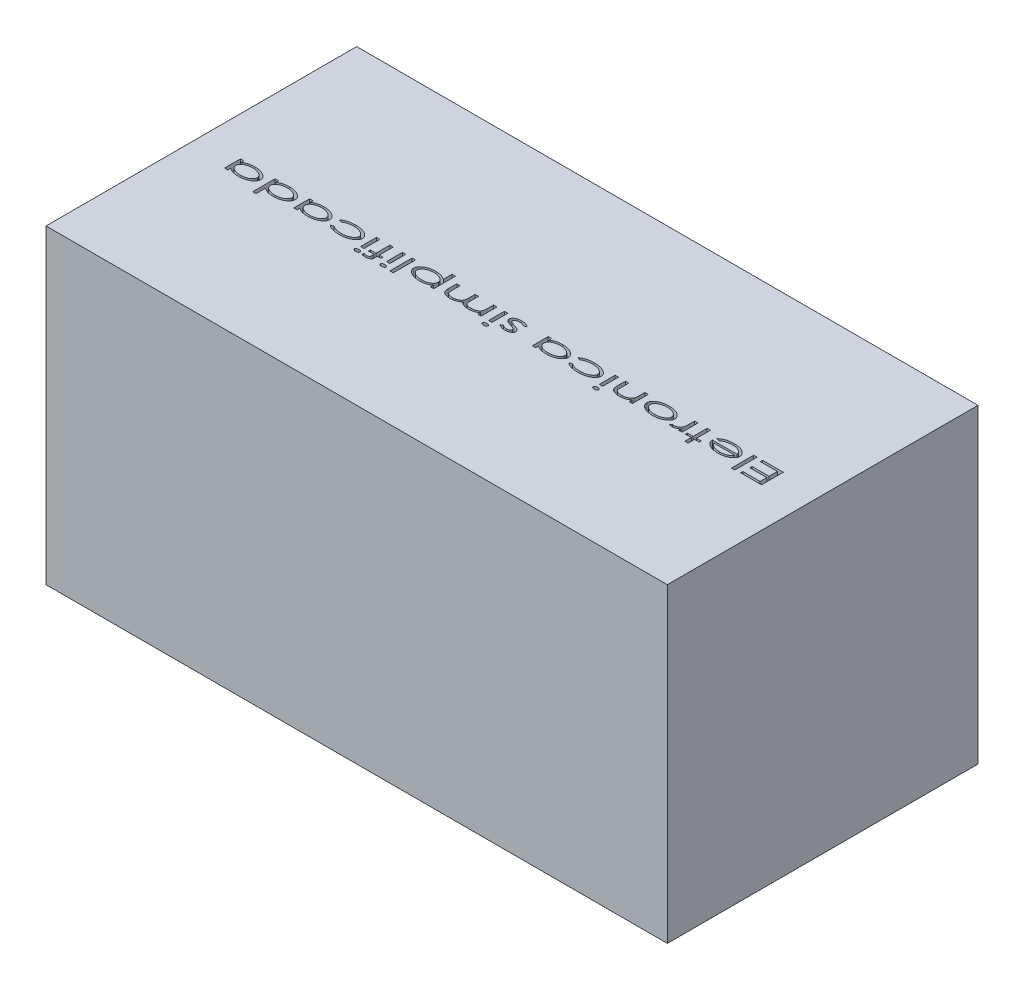
from build123d import *

# Parameters (mm, degrees)
ESBO_O1_W                = 100
ESBO_O1_H                = 50
RESSALTO_EXTRUS_O1_DEPTH = 25
ESBO_O2_W                = 0.538461538
ESBO_O2_H                = 3.58974359
ESBO_O2_H_2              = 2.557692308
ESBO_O2_W_2              = 0.538461539
CORTE_EXTRUS_O1_DEPTH    = 3


with BuildPart() as part:
    # Esboço1 → Ressalto-extrusão1 (new, symmetric)
    with BuildSketch(Plane.XY):
        Rectangle(ESBO_O1_W, ESBO_O1_H)
    extrude(amount=RESSALTO_EXTRUS_O1_DEPTH, both=True)

    # Esboço2 → Corte-extrusão1 (cut)
    # profile 1 of 26: a face of its own
    with BuildSketch(Plane(origin=(0, 25, 0), x_dir=(1, 0, 0), z_dir=(0, 1, 0))):
        Polygon((43.66025641, -3.5), (40.294871795, -3.5), (40.294871795, -3.141025641), (43.076923077, -3.141025641), (43.076923077, -2.064102564), (40.33974359, -2.064102564), (40.33974359, -1.705128205), (43.076923077, -1.705128205), (43.076923077, -0.358974359), (40.33974359, -0.358974359), (40.33974359, 0), (43.66025641, 0), align=None)
    # profile 2 of 26: a face of its own
    with BuildSketch(Plane(origin=(0, 25, 0), x_dir=(1, 0, 0), z_dir=(0, 1, 0))):
        with Locations((39.173076923, -1.794871795)):
            Rectangle(ESBO_O2_W, ESBO_O2_H)
    # profile 3 of 26: a face of its own
    with BuildSketch(Plane(origin=(0, 25, 0), x_dir=(1, 0, 0), z_dir=(0, 1, 0))):
        with BuildLine():
            Line((34.121494391, -0.807692308), (33.653846154, -0.661157853))
            add(Edge.make_bspline(
                [(33.653846154, -0.661157853), (33.692815139, -0.621304319), (33.77060426, -0.541749479), (33.900607337, -0.437465528), (34.037855487, -0.342863055), (34.185536452, -0.262016639), (34.34151526, -0.190137241), (34.50706123, -0.128930798), (34.681240781, -0.075140301), (34.865915293, -0.031957364), (35.061380687, 0.002243883), (35.26867714, 0.027563359), (35.488468932, 0.042181209), (35.639167354, 0.043958968), (35.716546474, 0.044871795)],
                knots=[0, 0, 0, 0, 0.893951948, 1.784489309, 2.6699397, 3.56662651, 4.483111967, 5.424449689, 6.397477057, 7.40746252, 8.46640008, 9.581243957, 10.758041303, 12, 12, 12, 12], degree=3))
            add(Edge.make_bspline(
                [(35.716546474, 0.044871795), (35.802120444, 0.043733577), (35.968580598, 0.041519493), (36.211114977, 0.022281838), (36.439477424, -0.00880818), (36.65370115, -0.052656563), (36.853566036, -0.109165959), (37.038901642, -0.178694101), (37.210151349, -0.260383383), (37.365128346, -0.355265844), (37.504009434, -0.456851896), (37.625632183, -0.562876943), (37.728605054, -0.672506847), (37.814289803, -0.785097044), (37.879957136, -0.902009847), (37.927039542, -1.022256883), (37.956462885, -1.145851714), (37.959846734, -1.229843787), (37.961538462, -1.271834936)],
                knots=[0, 0, 0, 0, 1.436567166, 2.79443844, 4.081859484, 5.303901173, 6.462716308, 7.565384014, 8.623648603, 9.643165491, 10.611628061, 11.509712271, 12.348097254, 13.132869404, 13.879486384, 14.591394117, 15.295779037, 16, 16, 16, 16], degree=3))
            add(Edge.make_bspline(
                [(37.961538462, -1.271834936), (37.960112624, -1.311216273), (37.957268336, -1.389774879), (37.932451188, -1.505716714), (37.891855125, -1.618155653), (37.836077948, -1.727644449), (37.763657807, -1.833145074), (37.675684557, -1.935252895), (37.572389166, -2.034676981), (37.494279858, -2.094760408), (37.453926282, -2.125801282)],
                knots=[0, 0, 0, 0, 0.914806648, 1.824872872, 2.742660009, 3.687957696, 4.673591136, 5.710278341, 6.817062154, 8, 8, 8, 8], degree=3))
            add(Edge.make_bspline(
                [(37.453926282, -2.125801282), (37.398802179, -2.164132803), (37.287322449, -2.241652205), (37.104084964, -2.337695227), (36.908109167, -2.419657248), (36.698750253, -2.487300671), (36.475599477, -2.538735153), (36.238932761, -2.57542521), (35.988795151, -2.59825985), (35.817558, -2.601106393), (35.729867788, -2.602564103)],
                knots=[0, 0, 0, 0, 0.88514031, 1.790055462, 2.722933726, 3.685384331, 4.689131802, 5.741042054, 6.843192027, 8, 8, 8, 8], degree=3))
            add(Edge.make_bspline(
                [(35.729867788, -2.602564103), (35.684056117, -2.602105232), (35.59356753, -2.601198856), (35.459807164, -2.59566407), (35.329548019, -2.585898838), (35.202861432, -2.571690923), (35.079299386, -2.554520419), (34.959653187, -2.532525139), (34.843190659, -2.507723437), (34.730794173, -2.47697679), (34.621044613, -2.444537102), (34.515089952, -2.407235196), (34.412575291, -2.36591937), (34.313919551, -2.320360962), (34.218645845, -2.27108084), (34.127085194, -2.217736107), (34.038228334, -2.161238302), (33.981979301, -2.11981677), (33.953926282, -2.099158654)],
                knots=[0, 0, 0, 0, 1.170317765, 2.31164674, 3.419312168, 4.506515235, 5.567837494, 6.605401055, 7.6136766, 8.608588898, 9.581309747, 10.536745852, 11.476894294, 12.403850968, 13.31175037, 14.215951753, 15.110243563, 16, 16, 16, 16], degree=3))
            add(Edge.make_bspline(
                [(33.953926282, -2.099158654), (33.916357099, -2.069279225), (33.84319346, -2.011090901), (33.746401239, -1.913237611), (33.663736638, -1.81040247), (33.5967699, -1.700985848), (33.542399381, -1.587158793), (33.50501143, -1.466660176), (33.480077771, -1.341082825), (33.476283251, -1.255127915), (33.474358974, -1.211538462)],
                knots=[0, 0, 0, 0, 1.09939349, 2.141000206, 3.14737153, 4.11660672, 5.075110584, 6.030556246, 7.001255684, 8, 8, 8, 8], degree=3))
            Line((33.474358974, -1.211538462), (37.423076923, -1.211538462))
            add(Edge.make_bspline(
                [(37.423076923, -1.211538462), (37.420358466, -1.177730179), (37.414964101, -1.11064279), (37.388861576, -1.013039844), (37.349246169, -0.920238799), (37.295268918, -0.832259747), (37.2260761, -0.749984961), (37.143552687, -0.671845881), (37.046458128, -0.599052051), (36.937205789, -0.530911618), (36.817022624, -0.470001048), (36.689412075, -0.41593206), (36.554703979, -0.370132735), (36.413111653, -0.333312196), (36.26464972, -0.304449474), (36.109362571, -0.284629586), (35.947208203, -0.271467514), (35.836698853, -0.269986142), (35.780348558, -0.269230769)],
                knots=[0, 0, 0, 0, 0.783756855, 1.555246174, 2.325919574, 3.112657638, 3.934789788, 4.807207792, 5.737651772, 6.738812374, 7.78394596, 8.852955656, 9.944354923, 11.074053091, 12.23679903, 13.442539891, 14.695914586, 16, 16, 16, 16], degree=3))
            add(Edge.make_bspline(
                [(35.780348558, -0.269230769), (35.725408238, -0.269852264), (35.615879249, -0.271091276), (35.452794045, -0.282672089), (35.291791497, -0.301430577), (35.13493686, -0.328177413), (34.984863087, -0.359702693), (34.844884987, -0.39683896), (34.716630449, -0.438448631), (34.597246252, -0.486441796), (34.481689461, -0.545034415), (34.364711398, -0.617843191), (34.243055517, -0.705910404), (34.163147788, -0.772816339), (34.121494391, -0.807692308)],
                knots=[0, 0, 0, 0, 1.107354334, 2.207620964, 3.293931017, 4.373580615, 5.41399357, 6.384178679, 7.291462216, 8.130431343, 8.975292299, 9.899648912, 10.905152738, 12, 12, 12, 12], degree=3))
        make_face()
        with BuildLine():
            add(Edge.make_bspline(
                [(34.012820513, -1.525641026), (34.033111048, -1.567708737), (34.072959153, -1.650324527), (34.152983702, -1.761025317), (34.243188212, -1.860834779), (34.350465522, -1.945631861), (34.471948284, -2.020702579), (34.611006537, -2.085985394), (34.76664437, -2.145686203), (34.938436842, -2.195702498), (35.12111311, -2.236537524), (35.310703876, -2.266976785), (35.505176836, -2.284505416), (35.636350782, -2.287134996), (35.702524038, -2.288461538)],
                knots=[0, 0, 0, 0, 0.857527618, 1.684078322, 2.502439203, 3.324854635, 4.189720852, 5.124168279, 6.146056954, 7.253256661, 8.411934189, 9.587230759, 10.782831465, 12, 12, 12, 12], degree=3))
            add(Edge.make_bspline(
                [(35.702524038, -2.288461538), (35.756763827, -2.287859734), (35.863494304, -2.286675532), (36.020535659, -2.275222088), (36.171979053, -2.256409395), (36.31754697, -2.229799443), (36.457328905, -2.196215469), (36.591441294, -2.155554635), (36.719643933, -2.106860432), (36.801423694, -2.067923958), (36.841846955, -2.048677885)],
                knots=[0, 0, 0, 0, 1.107946955, 2.180165322, 3.214750959, 4.224289184, 5.201668333, 6.150153837, 7.085631768, 8, 8, 8, 8], degree=3))
            add(Edge.make_bspline(
                [(36.841846955, -2.048677885), (36.870155913, -2.033708192), (36.926385532, -2.003974138), (37.005377448, -1.951734321), (37.079788769, -1.894731392), (37.148280174, -1.831826564), (37.21109838, -1.76292385), (37.269187918, -1.689526895), (37.322623739, -1.610644406), (37.352538302, -1.554217829), (37.367688301, -1.525641026)],
                knots=[0, 0, 0, 0, 1.017964425, 2.021966066, 3.007668941, 3.996673262, 4.97517538, 5.970028059, 6.971936421, 8, 8, 8, 8], degree=3))
            Line((37.367688301, -1.525641026), (34.012820513, -1.525641026))
        make_face(mode=Mode.SUBTRACT)
    # profile 4 of 26: a face of its own
    with BuildSketch(Plane(origin=(0, 25, 0), x_dir=(1, 0, 0), z_dir=(0, 1, 0))):
        Polygon((31.948717949, -3.58974359), (31.41025641, -3.58974359), (31.41025641, -2.557692308), (30.512820513, -2.557692308), (30.512820513, -2.243589744), (31.41025641, -2.243589744), (31.41025641, 0), (31.948717949, 0), (31.948717949, -2.243589744), (32.711538462, -2.243589744), (32.711538462, -2.557692308), (31.948717949, -2.557692308), align=None)
    # profile 5 of 26: a face of its own
    with BuildSketch(Plane(origin=(0, 25, 0), x_dir=(1, 0, 0), z_dir=(0, 1, 0))):
        with BuildLine():
            Line((29.929487179, -2.557692308), (29.391025641, -2.557692308))
            Line((29.391025641, -2.557692308), (29.391025641, -2.181189904))
            add(Edge.make_bspline(
                [(29.391025641, -2.181189904), (29.350094812, -2.216629801), (29.269733261, -2.286210729), (29.139988702, -2.374186734), (29.007696392, -2.448114142), (28.871395213, -2.505804659), (28.732179174, -2.549066172), (28.590297381, -2.580203566), (28.445474348, -2.598783375), (28.347809383, -2.601298726), (28.298677885, -2.602564103)],
                knots=[0, 0, 0, 0, 1.082928023, 2.126166942, 3.131242515, 4.112219607, 5.082824122, 6.045379796, 7.016705548, 8, 8, 8, 8], degree=3))
            add(Edge.make_bspline(
                [(28.298677885, -2.602564103), (28.260764722, -2.601379745), (28.183215753, -2.598957218), (28.065226585, -2.582040392), (27.94322942, -2.554820834), (27.862153484, -2.528461865), (27.820512821, -2.514923878)],
                knots=[0, 0, 0, 0, 0.931680211, 1.905692724, 2.924362168, 4, 4, 4, 4], degree=3))
            Line((27.820512821, -2.514923878), (28.110076122, -2.242888622))
            add(Edge.make_bspline(
                [(28.110076122, -2.242888622), (28.137137893, -2.249638747), (28.188705351, -2.262501424), (28.262962495, -2.277632935), (28.330709053, -2.286562264), (28.373675513, -2.287851008), (28.394030449, -2.288461538)],
                knots=[0, 0, 0, 0, 1.160725492, 2.21181613, 3.152865595, 4, 4, 4, 4], degree=3))
            add(Edge.make_bspline(
                [(28.394030449, -2.288461538), (28.438562548, -2.286882728), (28.527409971, -2.283732791), (28.658936056, -2.256942435), (28.78824135, -2.215836899), (28.892067815, -2.166696319), (28.972264822, -2.119748443), (29.029250925, -2.078868877), (29.082498558, -2.033128733), (29.132352433, -1.983362142), (29.178630278, -1.92907877), (29.219334526, -1.868903614), (29.258516169, -1.805529892), (29.280403409, -1.760261022), (29.291466346, -1.737379808)],
                knots=[0, 0, 0, 0, 1.437633438, 2.86826873, 4.320229324, 5.813373766, 6.568405057, 7.320712507, 8.075894834, 8.834129177, 9.595066147, 10.376412742, 11.179355518, 12, 12, 12, 12], degree=3))
            add(Edge.make_bspline(
                [(29.291466346, -1.737379808), (29.299614792, -1.717193402), (29.31755606, -1.672746925), (29.336427028, -1.59697473), (29.354324687, -1.507927874), (29.367722417, -1.405068343), (29.377990744, -1.288102346), (29.385390375, -1.157626571), (29.390536688, -1.013161971), (29.390857476, -0.912398298), (29.391025641, -0.859575321)],
                knots=[0, 0, 0, 0, 0.587606262, 1.293792862, 2.105001855, 3.041868506, 4.094439897, 5.27739785, 6.572740085, 8, 8, 8, 8], degree=3))
            Line((29.391025641, -0.859575321), (29.391025641, 0))
            Line((29.391025641, 0), (29.929487179, 0))
            Line((29.929487179, 0), (29.929487179, -2.557692308))
        make_face()
    # profile 6 of 26: a face of its own
    with BuildSketch(Plane(origin=(0, 25, 0), x_dir=(1, 0, 0), z_dir=(0, 1, 0))):
        with BuildLine():
            add(Edge.make_bspline(
                [(25.23828125, -2.602564103), (25.156436952, -2.601533802), (24.995988977, -2.599513996), (24.760727203, -2.578340472), (24.536150673, -2.54581384), (24.322000467, -2.500709257), (24.118988878, -2.440756884), (23.926364834, -2.368726278), (23.744109354, -2.283630588), (23.630752629, -2.215157612), (23.574519231, -2.181189904)],
                knots=[0, 0, 0, 0, 1.12896406, 2.213226843, 3.256151804, 4.258570699, 5.229935321, 6.173824348, 7.094080541, 8, 8, 8, 8], degree=3))
            add(Edge.make_bspline(
                [(23.574519231, -2.181189904), (23.526807555, -2.149456527), (23.434876851, -2.088312758), (23.313513599, -1.983772677), (23.208011711, -1.877886561), (23.123151275, -1.765130304), (23.056083987, -1.648584444), (23.009742725, -1.526631634), (22.979092485, -1.400954166), (22.975941954, -1.31501496), (22.974358974, -1.271834936)],
                knots=[0, 0, 0, 0, 1.206280956, 2.324258314, 3.369012415, 4.34999327, 5.289440065, 6.192090253, 7.091618472, 8, 8, 8, 8], degree=3))
            add(Edge.make_bspline(
                [(22.974358974, -1.271834936), (22.976138636, -1.2284101), (22.979684178, -1.14189668), (23.011759874, -1.015088428), (23.061146455, -0.892066406), (23.131559322, -0.77377319), (23.222120427, -0.660003629), (23.332087037, -0.550833879), (23.461917867, -0.446044712), (23.609332381, -0.346256948), (23.772367109, -0.253928171), (23.948960013, -0.174570657), (24.136243789, -0.105952828), (24.335026961, -0.051277151), (24.544786791, -0.007475745), (24.765930842, 0.022843764), (24.998415942, 0.041270497), (25.157149935, 0.043653703), (25.23828125, 0.044871795)],
                knots=[0, 0, 0, 0, 0.725420009, 1.445222878, 2.174929507, 2.937381318, 3.739171602, 4.601787355, 5.524499842, 6.526561306, 7.577037531, 8.654931429, 9.761988951, 10.9108266, 12.100960465, 13.344570866, 14.642770499, 16, 16, 16, 16], degree=3))
            add(Edge.make_bspline(
                [(25.23828125, 0.044871795), (25.319645752, 0.043651631), (25.478845502, 0.041264228), (25.71203609, 0.022863469), (25.934085506, -0.007582916), (26.14461708, -0.051073071), (26.34381882, -0.105974891), (26.5311132, -0.174560808), (26.707686417, -0.253945775), (26.870786678, -0.346198829), (27.018126071, -0.446344804), (27.14871077, -0.55030573), (27.257842779, -0.660515357), (27.349312033, -0.773499719), (27.419578724, -0.89210339), (27.469020708, -1.015078898), (27.501082206, -1.141899071), (27.504629644, -1.228410899), (27.506410256, -1.271834936)],
                knots=[0, 0, 0, 0, 1.359265908, 2.659572499, 3.905339477, 5.101482872, 6.248740255, 7.354274982, 8.430686201, 9.47971746, 10.480400555, 11.404875013, 12.263547657, 13.066659149, 13.828062182, 14.556765075, 15.275577831, 16, 16, 16, 16], degree=3))
            add(Edge.make_bspline(
                [(27.506410256, -1.271834936), (27.504722829, -1.314757765), (27.501357375, -1.400364284), (27.472093005, -1.52617222), (27.424781766, -1.647433266), (27.357313276, -1.763331676), (27.272500091, -1.875520664), (27.168421361, -1.982899564), (27.045601139, -2.085837172), (26.953854272, -2.147231268), (26.90625, -2.179086538)],
                knots=[0, 0, 0, 0, 0.904835125, 1.804629047, 2.71043145, 3.642727751, 4.625191653, 5.671641447, 6.791895387, 8, 8, 8, 8], degree=3))
            add(Edge.make_bspline(
                [(26.90625, -2.179086538), (26.850065093, -2.213383702), (26.736727631, -2.282568715), (26.553668712, -2.366908793), (26.361276289, -2.440352976), (26.157728694, -2.499812871), (25.943319617, -2.546065759), (25.717919468, -2.578265493), (25.48174602, -2.599553866), (25.320594563, -2.601546368), (25.23828125, -2.602564103)],
                knots=[0, 0, 0, 0, 0.905012713, 1.825612078, 2.768006717, 3.736664104, 4.740109084, 5.783308899, 6.867753407, 8, 8, 8, 8], degree=3))
        make_face()
        with BuildLine():
            add(Edge.make_bspline(
                [(25.240384615, -2.288461538), (25.298371853, -2.287490034), (25.412647868, -2.28557548), (25.58075301, -2.271330529), (25.742752329, -2.248189745), (25.898459589, -2.216431493), (26.047773822, -2.173917922), (26.190986212, -2.122863162), (26.328300945, -2.062602276), (26.457237243, -1.993063951), (26.575846504, -1.917734812), (26.680043035, -1.837213051), (26.768952513, -1.752973066), (26.841053418, -1.663960953), (26.898453232, -1.571485758), (26.938646819, -1.474434324), (26.963810991, -1.373371687), (26.966562018, -1.304465081), (26.967948718, -1.269731571)],
                knots=[0, 0, 0, 0, 1.268091688, 2.499040632, 3.686663865, 4.845461507, 5.971605237, 7.079046535, 8.168363806, 9.247742887, 10.279921791, 11.237907294, 12.123568356, 12.952156517, 13.73671063, 14.49513971, 15.241450368, 16, 16, 16, 16], degree=3))
            add(Edge.make_bspline(
                [(26.967948718, -1.269731571), (26.967332661, -1.247247188), (26.966099215, -1.202229813), (26.95426932, -1.135501722), (26.935943246, -1.069753018), (26.910568148, -1.005160454), (26.878195228, -0.941584967), (26.837803116, -0.879917211), (26.790467102, -0.819141906), (26.735842392, -0.760322971), (26.676104882, -0.702606579), (26.60954066, -0.649569712), (26.538601974, -0.599066173), (26.462983771, -0.550927753), (26.381150671, -0.507987539), (26.295013145, -0.467080681), (26.20366938, -0.430019229), (26.07446231, -0.38491725), (25.904707762, -0.338079518), (25.691729309, -0.298573826), (25.469336729, -0.27308334), (25.317579254, -0.270529721), (25.240384615, -0.269230769)],
                knots=[0, 0, 0, 0, 0.616439497, 1.234211693, 1.853446546, 2.486960056, 3.135103921, 3.807444132, 4.506530068, 5.246311939, 6.00830027, 6.783450363, 7.578839623, 8.397238176, 9.240677846, 10.112714333, 11.012964617, 11.943845594, 13.866767009, 15.837550204, 17.88268218, 20, 20, 20, 20], degree=3))
            add(Edge.make_bspline(
                [(25.240384615, -0.269230769), (25.163187905, -0.270513569), (25.011658739, -0.273031572), (24.789296253, -0.29871722), (24.576275141, -0.337972486), (24.406307875, -0.384922682), (24.277099681, -0.430018262), (24.185756129, -0.467080928), (24.099618549, -0.507987476), (24.017785463, -0.550927769), (23.942167256, -0.599066169), (23.871228571, -0.649569713), (23.804664349, -0.702606579), (23.744926839, -0.760322971), (23.690302129, -0.819141906), (23.642966114, -0.879917211), (23.602574003, -0.941584967), (23.570201083, -1.005160454), (23.544825985, -1.069753018), (23.52649991, -1.135501722), (23.514670016, -1.202229813), (23.51343657, -1.247247188), (23.512820513, -1.269731571)],
                knots=[0, 0, 0, 0, 2.117325447, 4.156091067, 6.13318304, 8.056111382, 8.986995712, 9.887249239, 10.759288868, 11.602731576, 12.421133076, 13.216525201, 13.991678087, 14.753669163, 15.493453699, 16.192542153, 16.864884786, 17.513030985, 18.146546777, 18.765783861, 19.383558283, 20, 20, 20, 20], degree=3))
            add(Edge.make_bspline(
                [(23.512820513, -1.269731571), (23.514136357, -1.304480551), (23.516748908, -1.373473128), (23.542991769, -1.474358681), (23.583112101, -1.571255356), (23.639546858, -1.664413214), (23.712633162, -1.752701107), (23.801372331, -1.837246554), (23.905747456, -1.91791876), (24.024958361, -1.993054507), (24.154421139, -2.062445376), (24.291880651, -2.122865695), (24.435294205, -2.174060711), (24.584702578, -2.216204669), (24.740328906, -2.248307542), (24.901665601, -2.271211807), (25.069050081, -2.285618553), (25.182629536, -2.287503198), (25.240384615, -2.288461538)],
                knots=[0, 0, 0, 0, 0.7587768, 1.506518025, 2.265174238, 3.047310772, 3.879373511, 4.765299808, 5.723572205, 6.760367934, 7.844576165, 8.934219661, 10.041992612, 11.173393989, 12.327532708, 13.515511607, 14.736639273, 16, 16, 16, 16], degree=3))
        make_face(mode=Mode.SUBTRACT)
    # profile 7 of 26: a face of its own
    with BuildSketch(Plane(origin=(0, 25, 0), x_dir=(1, 0, 0), z_dir=(0, 1, 0))):
        with BuildLine():
            Line((21.942307692, -2.557692308), (21.403846154, -2.557692308))
            Line((21.403846154, -2.557692308), (21.403846154, -2.096354167))
            add(Edge.make_bspline(
                [(21.403846154, -2.096354167), (21.348799546, -2.13865289), (21.239523437, -2.222622456), (21.061761485, -2.327595792), (20.876306467, -2.415864767), (20.681405093, -2.485399162), (20.47795044, -2.537435421), (20.266382121, -2.575380505), (20.046038248, -2.598135371), (19.896254302, -2.60107022), (19.820012019, -2.602564103)],
                knots=[0, 0, 0, 0, 0.981304686, 1.948042953, 2.913763077, 3.883188615, 4.870318371, 5.881358971, 6.921579825, 8, 8, 8, 8], degree=3))
            add(Edge.make_bspline(
                [(19.820012019, -2.602564103), (19.780969121, -2.602253327), (19.704219612, -2.601642413), (19.590585484, -2.594022084), (19.480299377, -2.583500199), (19.373356957, -2.56658114), (19.269584897, -2.54801041), (19.169493352, -2.521879194), (19.072482367, -2.492941918), (18.979226759, -2.459447304), (18.891209244, -2.421479375), (18.808127715, -2.380977812), (18.731140142, -2.337172738), (18.660617225, -2.289463068), (18.595092056, -2.240403883), (18.5365449, -2.186497443), (18.484080495, -2.129551693), (18.435704438, -2.069571833), (18.39496679, -2.002384458), (18.358727032, -1.928193361), (18.328988911, -1.845100053), (18.304584682, -1.753620841), (18.285806912, -1.653766345), (18.272939324, -1.545305298), (18.264256029, -1.428559045), (18.26330872, -1.347806627), (18.262820513, -1.306189904)],
                knots=[0, 0, 0, 0, 1.207040548, 2.372768784, 3.520414569, 4.63136518, 5.719877706, 6.778522299, 7.827876553, 8.849696338, 9.840349948, 10.790533923, 11.70660622, 12.576476576, 13.422022205, 14.23529814, 15.033046484, 15.815192675, 16.613399138, 17.456966012, 18.364561809, 19.337475539, 20.382041157, 21.503379083, 22.713336575, 24, 24, 24, 24], degree=3))
            Line((18.262820513, -1.306189904), (18.262820513, 0))
            Line((18.262820513, 0), (18.801282051, 0))
            Line((18.801282051, 0), (18.801282051, -1.203125))
            add(Edge.make_bspline(
                [(18.801282051, -1.203125), (18.801500083, -1.237946686), (18.801917139, -1.304554646), (18.802760716, -1.399942059), (18.806617058, -1.486171723), (18.810787613, -1.563531071), (18.81527842, -1.631852618), (18.82169359, -1.691232816), (18.82871024, -1.741460095), (18.83590816, -1.771539545), (18.839142628, -1.78505609)],
                knots=[0, 0, 0, 0, 1.43050989, 2.736321963, 3.918161343, 4.975788514, 5.919036678, 6.730096082, 7.429354188, 8, 8, 8, 8], degree=3))
            add(Edge.make_bspline(
                [(18.839142628, -1.78505609), (18.844730581, -1.805549607), (18.855748718, -1.845958037), (18.880629369, -1.903311738), (18.912568887, -1.956496423), (18.951542215, -2.005619074), (18.996567311, -2.051627941), (19.048937489, -2.093149676), (19.108303212, -2.130020288), (19.173574291, -2.163912767), (19.245208191, -2.192746817), (19.321838258, -2.219027535), (19.403899134, -2.240528108), (19.491058339, -2.257785586), (19.583186197, -2.272011468), (19.680782729, -2.281634693), (19.783723342, -2.287128869), (19.854126602, -2.288010669), (19.890124199, -2.288461538)],
                knots=[0, 0, 0, 0, 0.810829382, 1.598766115, 2.379790989, 3.174729951, 3.989287755, 4.834402025, 5.721318439, 6.655864458, 7.640881509, 8.668760731, 9.749579704, 10.879135558, 12.062473444, 13.309973802, 14.624573909, 16, 16, 16, 16], degree=3))
            add(Edge.make_bspline(
                [(19.890124199, -2.288461538), (19.931741557, -2.287991262), (20.013911048, -2.287062745), (20.135613707, -2.277617329), (20.254078614, -2.262423124), (20.369183699, -2.240533311), (20.480811829, -2.213156383), (20.589477827, -2.180455192), (20.694339273, -2.140145177), (20.795664934, -2.095116678), (20.890569005, -2.04478107), (20.978883826, -1.992779248), (21.05759929, -1.936308329), (21.128121471, -1.877445686), (21.190204172, -1.815597983), (21.243956524, -1.750743041), (21.289368633, -1.683011393), (21.312535468, -1.634844315), (21.323918269, -1.611177885)],
                knots=[0, 0, 0, 0, 1.199975762, 2.369237294, 3.517863005, 4.642752899, 5.746136295, 6.831317406, 7.912808697, 8.983769397, 10.026861843, 11.009338657, 11.936976987, 12.817177134, 13.655942545, 14.460205079, 15.243436563, 16, 16, 16, 16], degree=3))
            add(Edge.make_bspline(
                [(21.323918269, -1.611177885), (21.330569905, -1.593996085), (21.344902032, -1.556974852), (21.360275099, -1.495020459), (21.373200398, -1.423514615), (21.385520999, -1.342706524), (21.393161186, -1.251824305), (21.399735804, -1.151560411), (21.402899535, -1.041418901), (21.403521806, -0.964744699), (21.403846154, -0.924779647)],
                knots=[0, 0, 0, 0, 0.636109682, 1.370611077, 2.200527186, 3.147273199, 4.19349023, 5.35054945, 6.619021473, 8, 8, 8, 8], degree=3))
            Line((21.403846154, -0.924779647), (21.403846154, 0))
            Line((21.403846154, 0), (21.942307692, 0))
            Line((21.942307692, 0), (21.942307692, -2.557692308))
        make_face()
    # profile 8 of 26: a face of its own
    with BuildSketch(Plane(origin=(0, 25, 0), x_dir=(1, 0, 0), z_dir=(0, 1, 0))):
        with BuildLine():
            add(Edge.make_bspline(
                [(16.873898237, -3.634615385), (16.843926788, -3.63370918), (16.78570293, -3.631948746), (16.701582074, -3.617306604), (16.624561509, -3.591765748), (16.555859297, -3.558190564), (16.497974885, -3.517801494), (16.455270606, -3.471160042), (16.428049841, -3.419143632), (16.424725897, -3.382273335), (16.423076923, -3.363982372)],
                knots=[0, 0, 0, 0, 1.249248024, 2.426844278, 3.545505327, 4.621984803, 5.606441795, 6.46915246, 7.24056277, 8, 8, 8, 8], degree=3))
            add(Edge.make_bspline(
                [(16.423076923, -3.363982372), (16.42476007, -3.346163947), (16.42817752, -3.309985547), (16.455302526, -3.258848999), (16.49822826, -3.212977296), (16.555824891, -3.172544396), (16.624571469, -3.139013403), (16.701579222, -3.113459786), (16.78570371, -3.098821262), (16.843927053, -3.097060315), (16.873898237, -3.096153846)],
                knots=[0, 0, 0, 0, 0.74345859, 1.5095129, 2.36876582, 3.357576204, 4.438816006, 5.562423913, 6.745227645, 8, 8, 8, 8], degree=3))
            add(Edge.make_bspline(
                [(16.873898237, -3.096153846), (16.903409174, -3.097032567), (16.960488018, -3.098732153), (17.04313884, -3.113686502), (17.119088439, -3.138928655), (17.187267419, -3.172968085), (17.245306171, -3.212726051), (17.288270639, -3.258873515), (17.315416032, -3.309979915), (17.31883093, -3.346162088), (17.320512821, -3.363982372)],
                knots=[0, 0, 0, 0, 1.244331773, 2.406735513, 3.529268135, 4.609650663, 5.613771196, 6.479358689, 7.251060495, 8, 8, 8, 8], degree=3))
            add(Edge.make_bspline(
                [(17.320512821, -3.363982372), (17.318865147, -3.382275261), (17.315543824, -3.419149439), (17.288302375, -3.471135217), (17.24556134, -3.518054867), (17.187233316, -3.55776723), (17.119098251, -3.591850334), (17.043136082, -3.617079985), (16.960488775, -3.632037831), (16.903409432, -3.63373692), (16.873898237, -3.634615385)],
                knots=[0, 0, 0, 0, 0.765011113, 1.542083182, 2.411125705, 3.410792995, 4.48638406, 5.603938284, 6.7611868, 8, 8, 8, 8], degree=3))
        make_face()
    # profile 9 of 26: a face of its own
    with BuildSketch(Plane(origin=(0, 25, 0), x_dir=(1, 0, 0), z_dir=(0, 1, 0))):
        with Locations((16.871794872, -1.278846154)):
            Rectangle(ESBO_O2_W, ESBO_O2_H_2)
    # profile 10 of 26: a face of its own
    with BuildSketch(Plane(origin=(0, 25, 0), x_dir=(1, 0, 0), z_dir=(0, 1, 0))):
        with BuildLine():
            Line((11.173076923, -2.003104968), (11.612680288, -1.83974359))
            add(Edge.make_bspline(
                [(11.612680288, -1.83974359), (11.662658964, -1.875942328), (11.763850735, -1.949233874), (11.931411951, -2.039274581), (12.111189157, -2.117101597), (12.304535834, -2.179679871), (12.510857664, -2.22876812), (12.730481702, -2.263366365), (12.963318637, -2.284680893), (13.123083255, -2.287180853), (13.204927885, -2.288461538)],
                knots=[0, 0, 0, 0, 0.878629052, 1.778959304, 2.703940385, 3.667686942, 4.67104556, 5.723482898, 6.833779969, 8, 8, 8, 8], degree=3))
            add(Edge.make_bspline(
                [(13.204927885, -2.288461538), (13.270617684, -2.287409715), (13.39956226, -2.285345059), (13.58875383, -2.272387846), (13.769330036, -2.248841641), (13.941426303, -2.218071693), (14.104808954, -2.176328195), (14.259624097, -2.126006398), (14.406445901, -2.067307717), (14.542601498, -1.998974116), (14.666873254, -1.92482056), (14.7760524, -1.846062605), (14.868445572, -1.762761965), (14.944361129, -1.675726072), (15.003610417, -1.584175777), (15.046624991, -1.488670934), (15.071915412, -1.388349098), (15.075249234, -1.320115859), (15.076923077, -1.285857372)],
                knots=[0, 0, 0, 0, 1.359966583, 2.669521234, 3.923157093, 5.128354251, 6.286553995, 7.411119076, 8.496438366, 9.556663961, 10.561492679, 11.489551938, 12.338989975, 13.131412973, 13.873574043, 14.588340778, 15.291235324, 16, 16, 16, 16], degree=3))
            add(Edge.make_bspline(
                [(15.076923077, -1.285857372), (15.076375345, -1.26336175), (15.075277721, -1.218281827), (15.06234677, -1.151400138), (15.043710701, -1.085238529), (15.01690382, -1.020151737), (14.981119019, -0.957063753), (14.938924897, -0.894286601), (14.889006318, -0.832540825), (14.831406348, -0.772719891), (14.767910739, -0.714295909), (14.697390314, -0.660164207), (14.62229187, -0.607653158), (14.540765293, -0.559575217), (14.453663845, -0.514695109), (14.360788581, -0.473118342), (14.261951703, -0.43588535), (14.158389708, -0.400333992), (14.050011673, -0.37029942), (13.938480758, -0.342247209), (13.823163018, -0.320498941), (13.704980635, -0.301025526), (13.583236338, -0.287559443), (13.458654549, -0.276836165), (13.330729879, -0.270415536), (13.244431469, -0.2696291), (13.200721154, -0.269230769)],
                knots=[0, 0, 0, 0, 0.694151187, 1.391038731, 2.097253951, 2.816020048, 3.559462777, 4.33453054, 5.151009413, 6.009058106, 6.89843814, 7.814219117, 8.753637218, 9.728252046, 10.735879208, 11.779925298, 12.870193724, 13.998235266, 15.161705546, 16.343870791, 17.55044015, 18.786257453, 20.043802731, 21.333688296, 22.649507825, 24, 24, 24, 24], degree=3))
            add(Edge.make_bspline(
                [(13.200721154, -0.269230769), (13.121445585, -0.270513554), (12.96634395, -0.273023307), (12.739358881, -0.294491832), (12.523504566, -0.329136455), (12.318815268, -0.378147631), (12.125193042, -0.441098276), (11.942877022, -0.518781203), (11.770653965, -0.608927167), (11.665056621, -0.681802512), (11.612680288, -0.717948718)],
                knots=[0, 0, 0, 0, 1.133712812, 2.218094579, 3.257865643, 4.258377957, 5.225635361, 6.166278682, 7.090473355, 8, 8, 8, 8], degree=3))
            Line((11.612680288, -0.717948718), (11.173076923, -0.545472756))
            add(Edge.make_bspline(
                [(11.173076923, -0.545472756), (11.199885316, -0.522428653), (11.254353282, -0.475608783), (11.343041218, -0.411333727), (11.438445106, -0.351080303), (11.540537039, -0.295182101), (11.64879687, -0.242045638), (11.764567677, -0.19432455), (11.886518298, -0.14922438), (12.015019564, -0.108720787), (12.149039236, -0.07243939), (12.287992178, -0.040942131), (12.431359635, -0.014261272), (12.579413559, 0.007378277), (12.732126481, 0.024198941), (12.889292204, 0.035694664), (13.05082378, 0.044106804), (13.160044686, 0.044614352), (13.215444712, 0.044871795)],
                knots=[0, 0, 0, 0, 0.781650653, 1.588119097, 2.419901812, 3.275954332, 4.161405362, 5.085905666, 6.044267464, 7.03661436, 8.064865362, 9.11447665, 10.187141636, 11.289561091, 12.423264963, 13.584505615, 14.774790858, 16, 16, 16, 16], degree=3))
            add(Edge.make_bspline(
                [(13.215444712, 0.044871795), (13.299850125, 0.043971563), (13.465361971, 0.042206286), (13.708005548, 0.023174834), (13.939795923, -0.005696584), (14.160557056, -0.046652754), (14.369971355, -0.101062942), (14.568901572, -0.165795384), (14.756676854, -0.243043206), (14.904352976, -0.317471268), (15.014951308, -0.382278087), (15.092487355, -0.431443055), (15.164717926, -0.481740742), (15.231500358, -0.533606734), (15.292686678, -0.587130431), (15.348732563, -0.641572274), (15.399508524, -0.697316446), (15.445525779, -0.754040074), (15.485286609, -0.812882955), (15.51965318, -0.872777459), (15.549789257, -0.933343038), (15.573294877, -0.995982938), (15.59244217, -1.059628683), (15.605831806, -1.124606992), (15.613613236, -1.190781158), (15.614791187, -1.23535639), (15.615384615, -1.2578125)],
                knots=[0, 0, 0, 0, 2.035579388, 3.991598274, 5.866927021, 7.66802848, 9.403129937, 11.082432872, 12.710336204, 14.296123053, 15.06670846, 15.80172767, 16.510173334, 17.18902237, 17.840251049, 18.470121317, 19.072684141, 19.658153859, 20.230420232, 20.783511953, 21.323049864, 21.860137799, 22.395239861, 22.924819874, 23.458345785, 24, 24, 24, 24], degree=3))
            add(Edge.make_bspline(
                [(15.615384615, -1.2578125), (15.614433586, -1.288017398), (15.612534951, -1.348318413), (15.597358832, -1.438013456), (15.571958183, -1.525880957), (15.536473427, -1.612037282), (15.491228512, -1.696482508), (15.436340367, -1.779352117), (15.371251874, -1.860456549), (15.296237763, -1.938975017), (15.213313379, -2.015467554), (15.121397693, -2.086607826), (15.02340625, -2.15513435), (14.916964125, -2.218045953), (14.803337332, -2.276801522), (14.682368338, -2.331612955), (14.553846943, -2.381997026), (14.418355904, -2.427974029), (14.277293993, -2.469120422), (14.131595122, -2.505051859), (13.981847779, -2.535037296), (13.827666491, -2.559384208), (13.669659818, -2.579404989), (13.507036698, -2.59211416), (13.340577996, -2.601050994), (13.228077246, -2.602056439), (13.171274038, -2.602564103)],
                knots=[0, 0, 0, 0, 0.712713157, 1.422859513, 2.140487918, 2.867868101, 3.61815181, 4.398500036, 5.210968237, 6.069498771, 6.959772946, 7.871363351, 8.810984941, 9.780764164, 10.787484229, 11.829384107, 12.914286182, 14.044784415, 15.205738202, 16.381863393, 17.586054106, 18.809563649, 20.065891143, 21.344573563, 22.659237939, 24, 24, 24, 24], degree=3))
            add(Edge.make_bspline(
                [(13.171274038, -2.602564103), (13.099731204, -2.601658803), (12.957661923, -2.599861065), (12.746451849, -2.584301292), (12.538762649, -2.56127271), (12.33701936, -2.52657476), (12.144907423, -2.485342602), (11.965932735, -2.437491682), (11.801910397, -2.385025828), (11.6522138, -2.325192091), (11.51595491, -2.257313569), (11.390338514, -2.182545549), (11.275734349, -2.098135751), (11.207107835, -2.03460765), (11.173076923, -2.003104968)],
                knots=[0, 0, 0, 0, 1.207056954, 2.396965618, 3.571946322, 4.731800245, 5.849509668, 6.886458722, 7.856712279, 8.753792175, 9.603864158, 10.422889924, 11.217933537, 12, 12, 12, 12], degree=3))
        make_face()
    # profile 11 of 26: a face of its own
    with BuildSketch(Plane(origin=(0, 25, 0), x_dir=(1, 0, 0), z_dir=(0, 1, 0))):
        with BuildLine():
            Line((5.833333333, -2.557692308), (5.833333333, 0))
            Line((5.833333333, 0), (6.371794872, 0))
            Line((6.371794872, 0), (6.371794872, -0.442407853))
            add(Edge.make_bspline(
                [(6.371794872, -0.442407853), (6.43187176, -0.402031283), (6.552283911, -0.321104494), (6.745994661, -0.219494952), (6.950575778, -0.136176647), (7.165367367, -0.068557878), (7.391121056, -0.017869046), (7.627061682, 0.017989753), (7.873124177, 0.041444515), (8.040643356, 0.043714924), (8.126001603, 0.044871795)],
                knots=[0, 0, 0, 0, 0.938239219, 1.880513557, 2.830608539, 3.799754029, 4.797525246, 5.828042699, 6.893294086, 8, 8, 8, 8], degree=3))
            add(Edge.make_bspline(
                [(8.126001603, 0.044871795), (8.201759249, 0.043641657), (8.350926268, 0.041219511), (8.57030283, 0.022667694), (8.78148439, -0.007402654), (8.984272196, -0.048982422), (9.178396585, -0.103957176), (9.364004638, -0.170581907), (9.541405679, -0.249095874), (9.681596425, -0.325138661), (9.787760208, -0.390790443), (9.862244261, -0.441198669), (9.931456615, -0.493230623), (9.996551899, -0.545468205), (10.055127205, -0.600269215), (10.10904568, -0.656125636), (10.15789055, -0.713155882), (10.201598132, -0.771760016), (10.240546524, -0.831207301), (10.273058468, -0.892643835), (10.302625987, -0.954411465), (10.325456765, -1.018146986), (10.343206713, -1.083339967), (10.355604451, -1.149706964), (10.363665233, -1.217419244), (10.364808643, -1.262931418), (10.365384615, -1.285857372)],
                knots=[0, 0, 0, 0, 1.910221612, 3.761231742, 5.547342857, 7.286875901, 8.977182977, 10.630730031, 12.255961248, 13.86456617, 14.647954761, 15.403147548, 16.131581695, 16.831119744, 17.506687542, 18.152742237, 18.78814494, 19.398709822, 19.995378431, 20.578147205, 21.150299885, 21.720780711, 22.282642255, 22.852483443, 23.421958801, 24, 24, 24, 24], degree=3))
            add(Edge.make_bspline(
                [(10.365384615, -1.285857372), (10.364812404, -1.308317366), (10.363676568, -1.352900309), (10.35556137, -1.419199649), (10.343308155, -1.484506537), (10.324701757, -1.548371047), (10.301757464, -1.611162698), (10.272504138, -1.672281859), (10.238957181, -1.732573595), (10.20029021, -1.791792937), (10.15589393, -1.849159435), (10.106461335, -1.905552271), (10.052094321, -1.960777217), (9.991902352, -2.014044236), (9.927236608, -2.066834273), (9.857496253, -2.118635776), (9.781914591, -2.168190319), (9.675243228, -2.234089676), (9.533436073, -2.309119405), (9.354887989, -2.387804011), (9.167992884, -2.454698933), (8.972330549, -2.50816392), (8.768755124, -2.551333914), (8.556520117, -2.581143335), (8.335936753, -2.598721041), (8.186096586, -2.601268341), (8.109875801, -2.602564103)],
                knots=[0, 0, 0, 0, 0.565836031, 1.123180875, 1.681023293, 2.238368136, 2.797359498, 3.363746876, 3.943747643, 4.535029439, 5.143994651, 5.770005591, 6.423792416, 7.095269321, 7.794278349, 8.526887031, 9.28311551, 10.070924054, 11.685900001, 13.320672047, 14.984055736, 16.682840239, 18.428026919, 20.224446955, 22.079449461, 24, 24, 24, 24], degree=3))
            add(Edge.make_bspline(
                [(8.109875801, -2.602564103), (8.022421974, -2.60111675), (7.851169844, -2.598282544), (7.600637834, -2.575156409), (7.362989836, -2.535580919), (7.173408997, -2.491182366), (7.029100121, -2.445808636), (6.925204305, -2.40796312), (6.824503737, -2.365810373), (6.727042024, -2.318963505), (6.633122434, -2.266934901), (6.542585895, -2.210761559), (6.455040974, -2.150466933), (6.399599433, -2.106490018), (6.371794872, -2.084435096)],
                knots=[0, 0, 0, 0, 1.701189811, 3.331270781, 4.888994601, 6.385456884, 7.114527815, 7.830826736, 8.535912457, 9.237485843, 9.933467971, 10.62361889, 11.309729279, 12, 12, 12, 12], degree=3))
            Line((6.371794872, -2.084435096), (6.371794872, -2.557692308))
            Line((6.371794872, -2.557692308), (5.833333333, -2.557692308))
        make_face()
        with BuildLine():
            add(Edge.make_bspline(
                [(8.097255609, -2.288461538), (8.173978213, -2.286850901), (8.324554131, -2.28368986), (8.545920752, -2.258633493), (8.758163004, -2.21752109), (8.927957623, -2.169151666), (9.057957712, -2.123726689), (9.14922303, -2.084733017), (9.23640494, -2.044534268), (9.317408792, -1.999201037), (9.394542737, -1.95186714), (9.465423557, -1.899811828), (9.53230291, -1.845740939), (9.592791584, -1.787837685), (9.647072749, -1.727841547), (9.695411484, -1.667324973), (9.736422025, -1.605594923), (9.769305599, -1.542519308), (9.795052293, -1.47865298), (9.813126374, -1.413994697), (9.825090893, -1.348465422), (9.826312854, -1.304371448), (9.826923077, -1.282351763)],
                knots=[0, 0, 0, 0, 2.104499795, 4.130295039, 6.103286387, 8.029463259, 8.968424389, 9.879406238, 10.751349596, 11.600819299, 12.424563468, 13.232560636, 14.011675186, 14.782647352, 15.527087068, 16.23005712, 16.905832747, 17.556850541, 18.17837195, 18.791368016, 19.396432346, 20, 20, 20, 20], degree=3))
            add(Edge.make_bspline(
                [(9.826923077, -1.282351763), (9.826295934, -1.260568199), (9.825033353, -1.216712914), (9.813227774, -1.151614225), (9.794869664, -1.086956881), (9.768932935, -1.023155983), (9.734753803, -0.960528287), (9.693611124, -0.898648347), (9.646186244, -0.836703423), (9.590361443, -0.776919349), (9.529538866, -0.718240888), (9.462230114, -0.663604019), (9.390505519, -0.611447613), (9.313794038, -0.562573492), (9.23163053, -0.517579685), (9.144719939, -0.475359434), (9.052331632, -0.437165008), (8.922468295, -0.390237771), (8.753187281, -0.340707499), (8.542109347, -0.300181042), (8.324150306, -0.273833468), (8.176326123, -0.270778116), (8.10146234, -0.269230769)],
                knots=[0, 0, 0, 0, 0.597995429, 1.20390124, 1.811573543, 2.442315632, 3.091577376, 3.768292824, 4.482358066, 5.23216176, 6.013284018, 6.802518436, 7.611639308, 8.448807301, 9.299458387, 10.183943426, 11.102115739, 12.044550564, 13.976950977, 15.940084459, 17.9439045, 20, 20, 20, 20], degree=3))
            add(Edge.make_bspline(
                [(8.10146234, -0.269230769), (8.025679393, -0.270897516), (7.875583655, -0.274198675), (7.653454259, -0.299019459), (7.437613507, -0.341232715), (7.263416806, -0.390031995), (7.129412604, -0.435283241), (7.035310117, -0.473476147), (6.946924595, -0.513835009), (6.864568434, -0.55746983), (6.788003626, -0.603785975), (6.71682428, -0.652611632), (6.652284009, -0.705326697), (6.594006281, -0.760730091), (6.541949858, -0.818364708), (6.496127866, -0.877577976), (6.458103364, -0.939369003), (6.426117827, -1.00219113), (6.40235782, -1.067547605), (6.384596898, -1.134353752), (6.373807503, -1.203242769), (6.372467953, -1.249829057), (6.371794872, -1.273237179)],
                knots=[0, 0, 0, 0, 2.071234786, 4.102288552, 6.100607706, 8.076788802, 9.042461065, 9.965390906, 10.851504072, 11.697395788, 12.511424176, 13.296460061, 14.054735064, 14.786748443, 15.492361438, 16.175941518, 16.830081769, 17.472894058, 18.099470686, 18.727023545, 19.360369969, 20, 20, 20, 20], degree=3))
            add(Edge.make_bspline(
                [(6.371794872, -1.273237179), (6.373251536, -1.308653086), (6.376138959, -1.378855095), (6.40015861, -1.481883134), (6.439819838, -1.580160421), (6.495529616, -1.673679831), (6.566569094, -1.762485252), (6.652797771, -1.84686896), (6.754931486, -1.926253376), (6.871093218, -2.000225701), (6.998674014, -2.067368187), (7.134059628, -2.127371056), (7.277197452, -2.177122991), (7.427514865, -2.217360313), (7.584728965, -2.250099966), (7.749266864, -2.271666403), (7.920764184, -2.286599576), (8.037626222, -2.287832456), (8.097255609, -2.288461538)],
                knots=[0, 0, 0, 0, 0.772404783, 1.531073807, 2.295603873, 3.077819596, 3.898487165, 4.771526676, 5.70536891, 6.717239184, 7.773903941, 8.849803665, 9.946975293, 11.07813685, 12.244775409, 13.449694693, 14.698695094, 16, 16, 16, 16], degree=3))
        make_face(mode=Mode.SUBTRACT)
    # profile 12 of 26: a face of its own
    with BuildSketch(Plane(origin=(0, 25, 0), x_dir=(1, 0, 0), z_dir=(0, 1, 0))):
        with BuildLine():
            Line((0.269230769, -2.238681891), (0.626101763, -2.019230769))
            add(Edge.make_bspline(
                [(0.626101763, -2.019230769), (0.659752535, -2.040656481), (0.725521805, -2.082532295), (0.826340808, -2.137566702), (0.926601107, -2.183931174), (1.026365807, -2.221998408), (1.125685428, -2.251805799), (1.224416586, -2.272668815), (1.322650908, -2.286034418), (1.387945834, -2.287654492), (1.420472756, -2.288461538)],
                knots=[0, 0, 0, 0, 1.125046303, 2.198864127, 3.237126333, 4.238636431, 5.208512458, 6.158834169, 7.082816032, 8, 8, 8, 8], degree=3))
            add(Edge.make_bspline(
                [(1.420472756, -2.288461538), (1.460291378, -2.287402203), (1.537411675, -2.285350493), (1.648439604, -2.265222465), (1.750578342, -2.232926309), (1.828571874, -2.195700461), (1.883779477, -2.160006871), (1.920057406, -2.132784818), (1.950324468, -2.103988272), (1.975275839, -2.074139452), (1.995338042, -2.043572156), (2.008650574, -2.011133898), (2.017642143, -1.978117634), (2.018702475, -1.955486399), (2.019230769, -1.944210737)],
                knots=[0, 0, 0, 0, 1.902593426, 3.684923372, 5.374396996, 7.013893299, 7.798211739, 8.51574709, 9.179760211, 9.790775765, 10.373648526, 10.919562898, 11.461688943, 12, 12, 12, 12], degree=3))
            add(Edge.make_bspline(
                [(2.019230769, -1.944210737), (2.017527703, -1.923747514), (2.014011971, -1.881504186), (1.981287008, -1.821753811), (1.933508008, -1.763027519), (1.890826887, -1.729978584), (1.867788462, -1.712139423)],
                knots=[0, 0, 0, 0, 0.849301535, 1.753258704, 2.787253502, 4, 4, 4, 4], degree=3))
            add(Edge.make_bspline(
                [(1.867788462, -1.712139423), (1.853674922, -1.702333561), (1.822793487, -1.680877631), (1.769166713, -1.6511724), (1.705058939, -1.620545126), (1.630799758, -1.588571876), (1.546232836, -1.554737857), (1.451287074, -1.519972528), (1.345770039, -1.484242645), (1.27187628, -1.460776593), (1.233273237, -1.448517628)],
                knots=[0, 0, 0, 0, 0.597954505, 1.308367301, 2.130709447, 3.070787716, 4.122267901, 5.301119492, 6.590070361, 8, 8, 8, 8], degree=3))
            add(Edge.make_bspline(
                [(1.233273237, -1.448517628), (1.185994866, -1.433301468), (1.095091668, -1.404045011), (0.965222976, -1.358558215), (0.847209032, -1.31332309), (0.74145758, -1.267270385), (0.646492988, -1.224040373), (0.564039413, -1.17946525), (0.492821365, -1.136072699), (0.451294508, -1.104360731), (0.431891026, -1.089543269)],
                knots=[0, 0, 0, 0, 1.350947568, 2.597497557, 3.742647052, 4.787733975, 5.734797952, 6.579555894, 7.336295479, 8, 8, 8, 8], degree=3))
            add(Edge.make_bspline(
                [(0.431891026, -1.089543269), (0.415533051, -1.0748308), (0.383799606, -1.046289532), (0.341133564, -1.000409729), (0.305344734, -0.952609147), (0.275646003, -0.903655804), (0.252919633, -0.853231355), (0.236603045, -0.801490282), (0.226553711, -0.748249855), (0.225090185, -0.712147922), (0.224358974, -0.694110577)],
                knots=[0, 0, 0, 0, 1.144109121, 2.219499876, 3.252839425, 4.24525054, 5.192009727, 6.122472087, 7.061944486, 8, 8, 8, 8], degree=3))
            add(Edge.make_bspline(
                [(0.224358974, -0.694110577), (0.225424068, -0.668777303), (0.227538886, -0.618476282), (0.245015586, -0.54454366), (0.273998047, -0.473855061), (0.315099785, -0.406745258), (0.365677058, -0.341596661), (0.428914496, -0.280387231), (0.504085981, -0.223454596), (0.588259418, -0.168120124), (0.681453813, -0.118270419), (0.781492524, -0.074910312), (0.886815539, -0.037509318), (0.998031519, -0.007694091), (1.114577462, 0.016324768), (1.236849689, 0.03293258), (1.36468735, 0.042772714), (1.451771902, 0.04416274), (1.49619391, 0.044871795)],
                knots=[0, 0, 0, 0, 0.75293855, 1.495013108, 2.246441441, 3.016707238, 3.828942915, 4.694255984, 5.626008814, 6.630702332, 7.688321301, 8.765593732, 9.871669932, 11.010136439, 12.188228629, 13.409435434, 14.678547727, 16, 16, 16, 16], degree=3))
            add(Edge.make_bspline(
                [(1.49619391, 0.044871795), (1.556070341, 0.043889565), (1.674682814, 0.041943812), (1.850536694, 0.023483205), (2.022403252, -0.004601013), (2.188331548, -0.045475512), (2.345366787, -0.09483135), (2.489984091, -0.153785691), (2.62088819, -0.221091309), (2.699129894, -0.275179052), (2.737179487, -0.301482372)],
                knots=[0, 0, 0, 0, 1.098001049, 2.1750899, 3.24000389, 4.290163743, 5.306999241, 6.256745379, 7.152240758, 8, 8, 8, 8], degree=3))
            Line((2.737179487, -0.301482372), (2.388020833, -0.538461538))
            add(Edge.make_bspline(
                [(2.388020833, -0.538461538), (2.354173338, -0.516967472), (2.287484587, -0.474618328), (2.183720293, -0.419693918), (2.078322132, -0.373164609), (1.971133074, -0.335465429), (1.86246999, -0.305599691), (1.752271581, -0.284759307), (1.640476187, -0.271626551), (1.56540707, -0.270031178), (1.527744391, -0.269230769)],
                knots=[0, 0, 0, 0, 1.05169542, 2.072125323, 3.077016049, 4.071922768, 5.050731614, 6.030864875, 7.012071709, 8, 8, 8, 8], degree=3))
            add(Edge.make_bspline(
                [(1.527744391, -0.269230769), (1.476694016, -0.27056923), (1.378004713, -0.27315671), (1.235911326, -0.297052134), (1.104882407, -0.334092956), (1.005579359, -0.379528854), (0.93516071, -0.422012498), (0.888710666, -0.453710811), (0.850980209, -0.488727145), (0.818434308, -0.52363059), (0.793947781, -0.561000628), (0.775742833, -0.599576578), (0.764903431, -0.639769729), (0.763511947, -0.667172652), (0.762820513, -0.680789263)],
                knots=[0, 0, 0, 0, 1.944636519, 3.75932252, 5.47626825, 7.122701775, 7.90192249, 8.611351017, 9.260976574, 9.860269378, 10.426114686, 10.956257324, 11.48136054, 12, 12, 12, 12], degree=3))
            add(Edge.make_bspline(
                [(0.762820513, -0.680789263), (0.764494383, -0.703316588), (0.76787163, -0.74876835), (0.799121418, -0.813455879), (0.846984306, -0.874000863), (0.889583773, -0.907190647), (0.912159455, -0.924779647)],
                knots=[0, 0, 0, 0, 0.90518339, 1.826323321, 2.848055182, 4, 4, 4, 4], degree=3))
            add(Edge.make_bspline(
                [(0.912159455, -0.924779647), (0.926534721, -0.933858049), (0.958329695, -0.953937508), (1.013786407, -0.982398519), (1.080557259, -1.013140392), (1.159736486, -1.043900086), (1.249368271, -1.079167844), (1.351830931, -1.113198021), (1.465523523, -1.150734757), (1.545461163, -1.175452203), (1.587339744, -1.188401442)],
                knots=[0, 0, 0, 0, 0.561246493, 1.241355688, 2.056405773, 2.98799142, 4.045815664, 5.236899491, 6.552437526, 8, 8, 8, 8], degree=3))
            add(Edge.make_bspline(
                [(1.587339744, -1.188401442), (1.632525701, -1.202881926), (1.719526944, -1.230762715), (1.84371659, -1.274873621), (1.956524569, -1.319128195), (2.058385934, -1.362042366), (2.148589029, -1.405804825), (2.227839696, -1.448684775), (2.295791244, -1.492125062), (2.335634876, -1.523030291), (2.354366987, -1.537560096)],
                knots=[0, 0, 0, 0, 1.344202451, 2.588133405, 3.732813637, 4.776933569, 5.718601321, 6.571986818, 7.328632946, 8, 8, 8, 8], degree=3))
            add(Edge.make_bspline(
                [(2.354366987, -1.537560096), (2.370489495, -1.552039336), (2.40175141, -1.580114916), (2.443745711, -1.625286108), (2.478751714, -1.672423321), (2.50827943, -1.720929184), (2.529439202, -1.771792269), (2.546456463, -1.823393907), (2.55529306, -1.877071118), (2.556888939, -1.913335167), (2.557692308, -1.931590545)],
                knots=[0, 0, 0, 0, 1.134275726, 2.19938674, 3.222335198, 4.204437191, 5.163632786, 6.100161109, 7.043618218, 8, 8, 8, 8], degree=3))
            add(Edge.make_bspline(
                [(2.557692308, -1.931590545), (2.556851829, -1.955288017), (2.555193731, -2.002038411), (2.538833681, -2.070289291), (2.513426205, -2.135448073), (2.477868344, -2.197868384), (2.431855151, -2.256876883), (2.37565252, -2.312415759), (2.310091938, -2.365366222), (2.23443574, -2.413573992), (2.151862423, -2.458243573), (2.063004729, -2.496569326), (1.969261628, -2.530067987), (1.869665029, -2.556073839), (1.765091242, -2.577419601), (1.655192011, -2.591683849), (1.540068076, -2.601257599), (1.461392187, -2.602122152), (1.421173878, -2.602564103)],
                knots=[0, 0, 0, 0, 0.781619933, 1.541980457, 2.304688985, 3.086080119, 3.906068112, 4.768601237, 5.690974149, 6.684584952, 7.727738889, 8.789131561, 9.878157959, 11.013014538, 12.186422643, 13.401651446, 14.671750842, 16, 16, 16, 16], degree=3))
            add(Edge.make_bspline(
                [(1.421173878, -2.602564103), (1.373452396, -2.601455923), (1.277485064, -2.599227388), (1.133477793, -2.581921326), (0.98942228, -2.552933299), (0.845329788, -2.512796602), (0.701118014, -2.461228996), (0.556683726, -2.398609206), (0.411471202, -2.325026243), (0.317247803, -2.267829719), (0.269230769, -2.238681891)],
                knots=[0, 0, 0, 0, 0.935479803, 1.881238748, 2.839184887, 3.814163286, 4.811286657, 5.839540841, 6.899011904, 8, 8, 8, 8], degree=3))
        make_face()
    # profile 13 of 26: a face of its own
    with BuildSketch(Plane(origin=(0, 25, 0), x_dir=(1, 0, 0), z_dir=(0, 1, 0))):
        with BuildLine():
            add(Edge.make_bspline(
                [(-0.940204327, -3.634615385), (-0.970175776, -3.63370918), (-1.028399634, -3.631948746), (-1.11252049, -3.617306604), (-1.189541055, -3.591765748), (-1.258243268, -3.558190564), (-1.316127679, -3.517801494), (-1.358831958, -3.471160042), (-1.386052723, -3.419143632), (-1.389376667, -3.382273335), (-1.391025641, -3.363982372)],
                knots=[0, 0, 0, 0, 1.249248024, 2.426844278, 3.545505327, 4.621984803, 5.606441795, 6.46915246, 7.24056277, 8, 8, 8, 8], degree=3))
            add(Edge.make_bspline(
                [(-1.391025641, -3.363982372), (-1.389342494, -3.346163947), (-1.385925044, -3.309985547), (-1.358800039, -3.258848999), (-1.315874304, -3.212977296), (-1.258277673, -3.172544396), (-1.189531095, -3.139013403), (-1.112523342, -3.113459786), (-1.028398854, -3.098821262), (-0.970175511, -3.097060315), (-0.940204327, -3.096153846)],
                knots=[0, 0, 0, 0, 0.74345859, 1.5095129, 2.36876582, 3.357576204, 4.438816006, 5.562423913, 6.745227645, 8, 8, 8, 8], degree=3))
            add(Edge.make_bspline(
                [(-0.940204327, -3.096153846), (-0.91069339, -3.097032567), (-0.853614546, -3.098732153), (-0.770963724, -3.113686502), (-0.695014125, -3.138928655), (-0.626835145, -3.172968085), (-0.568796393, -3.212726051), (-0.525831925, -3.258873515), (-0.498686532, -3.309979915), (-0.495271634, -3.346162088), (-0.493589744, -3.363982372)],
                knots=[0, 0, 0, 0, 1.244331773, 2.406735513, 3.529268135, 4.609650663, 5.613771196, 6.479358689, 7.251060495, 8, 8, 8, 8], degree=3))
            add(Edge.make_bspline(
                [(-0.493589744, -3.363982372), (-0.495237417, -3.382275261), (-0.498558741, -3.419149439), (-0.525800189, -3.471135217), (-0.568541224, -3.518054867), (-0.626869248, -3.55776723), (-0.695004313, -3.591850334), (-0.770966482, -3.617079985), (-0.853613789, -3.632037831), (-0.910693132, -3.63373692), (-0.940204327, -3.634615385)],
                knots=[0, 0, 0, 0, 0.765011113, 1.542083182, 2.411125705, 3.410792995, 4.48638406, 5.603938284, 6.7611868, 8, 8, 8, 8], degree=3))
        make_face()
    # profile 14 of 26: a face of its own
    with BuildSketch(Plane(origin=(0, 25, 0), x_dir=(1, 0, 0), z_dir=(0, 1, 0))):
        with Locations((-0.942307693, -1.278846154)):
            Rectangle(ESBO_O2_W_2, ESBO_O2_H_2)
    # profile 15 of 26: a face of its own
    with BuildSketch(Plane(origin=(0, 25, 0), x_dir=(1, 0, 0), z_dir=(0, 1, 0))):
        with BuildLine():
            Line((-2.423076923, -2.557692308), (-2.961538462, -2.557692308))
            Line((-2.961538462, -2.557692308), (-2.961538462, -2.11318109))
            add(Edge.make_bspline(
                [(-2.961538462, -2.11318109), (-3.009996078, -2.152343022), (-3.104657, -2.228845023), (-3.254363306, -2.327338076), (-3.405788999, -2.409755202), (-3.510319118, -2.452061695), (-3.561698718, -2.472856571)],
                knots=[0, 0, 0, 0, 1.062941775, 2.076434121, 3.054511296, 4, 4, 4, 4], degree=3))
            add(Edge.make_bspline(
                [(-3.561698718, -2.472856571), (-3.632936237, -2.492940036), (-3.776035266, -2.533282884), (-3.997062597, -2.573101095), (-4.223469557, -2.597508144), (-4.376339442, -2.600867776), (-4.453525641, -2.602564103)],
                knots=[0, 0, 0, 0, 0.981623857, 1.971846058, 2.975955964, 4, 4, 4, 4], degree=3))
            add(Edge.make_bspline(
                [(-4.453525641, -2.602564103), (-4.505668329, -2.601525049), (-4.608486996, -2.599476169), (-4.760997917, -2.586069792), (-4.909232899, -2.562994099), (-5.052094789, -2.531033899), (-5.186196357, -2.491383469), (-5.309439346, -2.446505541), (-5.419319742, -2.394307356), (-5.518444585, -2.336552196), (-5.607730463, -2.267475231), (-5.688501742, -2.185483364), (-5.76493684, -2.091659953), (-5.807752088, -2.021203371), (-5.829827724, -1.984875801)],
                knots=[0, 0, 0, 0, 1.18519765, 2.337057174, 3.47679956, 4.592873953, 5.661901381, 6.653585712, 7.570793253, 8.423524968, 9.256570972, 10.128026134, 11.034806128, 12, 12, 12, 12], degree=3))
            add(Edge.make_bspline(
                [(-5.829827724, -1.984875801), (-5.853344409, -2.009738628), (-5.900289268, -2.059370706), (-5.976672778, -2.128198368), (-6.057055653, -2.192460294), (-6.141715644, -2.25253635), (-6.230853531, -2.307714085), (-6.32406573, -2.359080259), (-6.42174081, -2.405317621), (-6.523353132, -2.446700124), (-6.628251534, -2.482466374), (-6.735033228, -2.515575242), (-6.844396837, -2.541361872), (-6.955276319, -2.564568677), (-7.068456612, -2.580720085), (-7.183199456, -2.593867742), (-7.300234206, -2.600592755), (-7.378832742, -2.601902126), (-7.418569712, -2.602564103)],
                knots=[0, 0, 0, 0, 0.936238515, 1.868953333, 2.810854456, 3.75136487, 4.707938805, 5.678268547, 6.662390427, 7.663592558, 8.678953109, 9.694635894, 10.721533183, 11.752564791, 12.793644312, 13.848831747, 14.912436412, 16, 16, 16, 16], degree=3))
            add(Edge.make_bspline(
                [(-7.418569712, -2.602564103), (-7.455269892, -2.602162219), (-7.527790503, -2.601368086), (-7.63493728, -2.595007454), (-7.738723422, -2.584262392), (-7.839480161, -2.570783281), (-7.936621766, -2.55133642), (-8.030980224, -2.529564069), (-8.12144393, -2.501516066), (-8.208880788, -2.4714629), (-8.291281172, -2.436199321), (-8.368898661, -2.398336307), (-8.44111981, -2.357348508), (-8.507448307, -2.312000602), (-8.568427913, -2.263794051), (-8.624239453, -2.212253554), (-8.674731111, -2.157876021), (-8.719755735, -2.099336544), (-8.759700333, -2.035599073), (-8.793325824, -1.964229588), (-8.820766508, -1.885248836), (-8.844917318, -1.799690437), (-8.862967126, -1.70658667), (-8.875174488, -1.606068276), (-8.882984906, -1.498185921), (-8.884061015, -1.423758729), (-8.884615385, -1.385416667)],
                knots=[0, 0, 0, 0, 1.207184908, 2.385432013, 3.529036281, 4.639073364, 5.727632587, 6.786747241, 7.822787684, 8.841542077, 9.826764622, 10.768810389, 11.681347152, 12.555581209, 13.409224461, 14.23614076, 15.052193622, 15.847152487, 16.66204577, 17.521725568, 18.43600931, 19.409646277, 20.443916832, 21.551928882, 22.73884676, 24, 24, 24, 24], degree=3))
            Line((-8.884615385, -1.385416667), (-8.884615385, 0))
            Line((-8.884615385, 0), (-8.346153846, 0))
            Line((-8.346153846, 0), (-8.346153846, -1.38681891))
            add(Edge.make_bspline(
                [(-8.346153846, -1.38681891), (-8.345981033, -1.419546433), (-8.345648766, -1.482471314), (-8.340478036, -1.57272936), (-8.333244436, -1.655154805), (-8.321942928, -1.729550943), (-8.308250898, -1.796136827), (-8.291597446, -1.854898), (-8.271754521, -1.90577857), (-8.239117791, -1.962772517), (-8.187502796, -2.025999835), (-8.108788194, -2.09140457), (-8.012624671, -2.14864444), (-7.900719784, -2.198706829), (-7.773708312, -2.238948472), (-7.633958515, -2.267947751), (-7.482361459, -2.285699713), (-7.3774879, -2.287519712), (-7.323217147, -2.288461538)],
                knots=[0, 0, 0, 0, 0.983781031, 1.891505966, 2.717207205, 3.470430783, 4.152560196, 4.759633316, 5.305020117, 5.789579514, 6.728897579, 7.741000511, 8.850820822, 10.083609458, 11.419066816, 12.84810098, 14.368931765, 16, 16, 16, 16], degree=3))
            add(Edge.make_bspline(
                [(-7.323217147, -2.288461538), (-7.256298489, -2.286643794), (-7.124985419, -2.283076874), (-6.932477924, -2.256999697), (-6.74924099, -2.212383592), (-6.603572256, -2.161840943), (-6.493958384, -2.112967204), (-6.41715144, -2.074220584), (-6.347134866, -2.030683592), (-6.28135535, -1.98651527), (-6.22245268, -1.937663473), (-6.168838647, -1.886495278), (-6.121082852, -1.832259778), (-6.077755469, -1.774769138), (-6.040766243, -1.709980149), (-6.008429716, -1.636824682), (-5.982066862, -1.553260024), (-5.961092396, -1.460273502), (-5.942974436, -1.35787976), (-5.932077958, -1.245606877), (-5.923720027, -1.123556675), (-5.923296618, -1.038845826), (-5.923076923, -0.994891827)],
                knots=[0, 0, 0, 0, 1.824139358, 3.579470097, 5.284006446, 6.958555799, 7.77433572, 8.55512777, 9.301467695, 10.020773743, 10.713397542, 11.384831147, 12.039364469, 12.68162616, 13.343897681, 14.068461494, 14.858325763, 15.728453896, 16.665957061, 17.691140141, 18.801999694, 20, 20, 20, 20], degree=3))
            Line((-5.923076923, -0.994891827), (-5.923076923, 0))
            Line((-5.923076923, 0), (-5.384615385, 0))
            Line((-5.384615385, 0), (-5.384615385, -1.300580929))
            add(Edge.make_bspline(
                [(-5.384615385, -1.300580929), (-5.384432647, -1.337279456), (-5.384080956, -1.407908246), (-5.379036812, -1.509159943), (-5.371464865, -1.601311895), (-5.361351496, -1.684236382), (-5.347525713, -1.757794282), (-5.330608607, -1.822198534), (-5.311829215, -1.877868998), (-5.280238849, -1.939854014), (-5.228454327, -2.007202908), (-5.150485413, -2.078504145), (-5.053351234, -2.139712076), (-4.9399832, -2.193323508), (-4.81145863, -2.236186823), (-4.670419751, -2.266699893), (-4.518041503, -2.284981069), (-4.412679227, -2.287274894), (-4.358173077, -2.288461538)],
                knots=[0, 0, 0, 0, 1.051455545, 2.023597119, 2.903942375, 3.700503122, 4.416290659, 5.046521062, 5.607800577, 6.095965762, 7.033493366, 8.024073494, 9.108844186, 10.310006803, 11.610256326, 12.981610175, 14.43852263, 16, 16, 16, 16], degree=3))
            add(Edge.make_bspline(
                [(-4.358173077, -2.288461538), (-4.294045823, -2.28695224), (-4.167356042, -2.28397047), (-3.980724391, -2.257009346), (-3.800433869, -2.214309123), (-3.655908135, -2.165006226), (-3.546265561, -2.117079557), (-3.469237174, -2.078934659), (-3.397775616, -2.037258167), (-3.332252177, -1.992649304), (-3.271858612, -1.945291171), (-3.217214367, -1.894897194), (-3.16793371, -1.841463957), (-3.123582448, -1.784564649), (-3.08430344, -1.722213827), (-3.051612917, -1.652073946), (-3.02365507, -1.574603989), (-3.000597869, -1.489744025), (-2.983291514, -1.397099772), (-2.970979114, -1.297110193), (-2.963136989, -1.189225875), (-2.962084147, -1.114797836), (-2.961538462, -1.076221955)],
                knots=[0, 0, 0, 0, 1.817387599, 3.590430359, 5.334294845, 7.065232044, 7.910980937, 8.725926477, 9.501022822, 10.254575718, 10.97176453, 11.675167689, 12.359843805, 13.030524307, 13.718176107, 14.444369678, 15.219975712, 16.051060354, 16.934791253, 17.889850923, 18.906314589, 20, 20, 20, 20], degree=3))
            Line((-2.961538462, -1.076221955), (-2.961538462, 0))
            Line((-2.961538462, 0), (-2.423076923, 0))
            Line((-2.423076923, 0), (-2.423076923, -2.557692308))
        make_face()
    # profile 16 of 26: a face of its own
    with BuildSketch(Plane(origin=(0, 25, 0), x_dir=(1, 0, 0), z_dir=(0, 1, 0))):
        with BuildLine():
            Line((-10.051282051, -2.557692308), (-10.58974359, -2.557692308))
            Line((-10.58974359, -2.557692308), (-10.58974359, -2.084435096))
            add(Edge.make_bspline(
                [(-10.58974359, -2.084435096), (-10.617543372, -2.106497541), (-10.672975386, -2.150489459), (-10.76042793, -2.210559465), (-10.85034362, -2.266958729), (-10.94358625, -2.318948946), (-11.04033429, -2.365826865), (-11.140164627, -2.407812494), (-11.242821929, -2.44583217), (-11.385052534, -2.491086892), (-11.571570019, -2.535532071), (-11.805243139, -2.575173026), (-12.051582867, -2.598284656), (-12.220037419, -2.601117162), (-12.306089744, -2.602564103)],
                knots=[0, 0, 0, 0, 0.698227978, 1.392247667, 2.086450192, 2.786432971, 3.491953818, 4.200928906, 4.916851112, 5.645555385, 7.136920919, 8.685384951, 10.306781697, 12, 12, 12, 12], degree=3))
            add(Edge.make_bspline(
                [(-12.306089744, -2.602564103), (-12.381610273, -2.601276742), (-12.529818908, -2.598750305), (-12.748064138, -2.581100858), (-12.957968491, -2.551333398), (-13.159456193, -2.508192714), (-13.353190241, -2.454544275), (-13.53834936, -2.387989406), (-13.715094888, -2.308916479), (-13.855587808, -2.234097315), (-13.961310486, -2.168192133), (-14.036194442, -2.118634682), (-14.105236019, -2.066836379), (-14.169199103, -2.014044488), (-14.228694727, -1.960772385), (-14.282352193, -1.905542186), (-14.331125696, -1.849175386), (-14.374739765, -1.791589349), (-14.413403311, -1.732568145), (-14.447163984, -1.672468928), (-14.475301323, -1.610957756), (-14.49875223, -1.548522614), (-14.516145785, -1.484371488), (-14.528705214, -1.419219118), (-14.53673647, -1.352895357), (-14.537883625, -1.308315707), (-14.538461538, -1.285857372)],
                knots=[0, 0, 0, 0, 1.916445628, 3.76101428, 5.552617734, 7.292828328, 8.986573569, 10.650640367, 12.280793178, 13.896815521, 14.685187972, 15.441868636, 16.174937027, 16.874338539, 17.546189016, 18.200479711, 18.827060403, 19.436768352, 20.032262176, 20.61639461, 21.184313666, 21.747287033, 22.307001845, 22.868818084, 23.430133205, 24, 24, 24, 24], degree=3))
            add(Edge.make_bspline(
                [(-14.538461538, -1.285857372), (-14.537785723, -1.262943902), (-14.536444855, -1.217481913), (-14.529854752, -1.14956652), (-14.516031164, -1.083423046), (-14.49847, -1.018262669), (-14.476405104, -0.954448457), (-14.447644641, -0.892484384), (-14.41501264, -0.831206827), (-14.376044057, -0.771956692), (-14.333097916, -0.713166199), (-14.284946939, -0.655903821), (-14.231029739, -0.600485225), (-14.173222927, -0.545677645), (-14.10941053, -0.492996007), (-14.040913865, -0.441233142), (-13.96716494, -0.390780834), (-13.861935545, -0.325135936), (-13.723066995, -0.24929585), (-13.547461872, -0.170414734), (-13.363400213, -0.103964166), (-13.171109457, -0.049181236), (-12.97048762, -0.00729609), (-12.761612226, 0.022651501), (-12.544340039, 0.041226006), (-12.396571673, 0.043643737), (-12.321514423, 0.044871795)],
                knots=[0, 0, 0, 0, 0.582019625, 1.154769276, 1.729666707, 2.295395321, 2.86780673, 3.441416458, 4.028196197, 4.628971438, 5.240205833, 5.876145028, 6.526646261, 7.202527361, 7.897721768, 8.626425115, 9.381914217, 10.165656237, 11.774906974, 13.395072372, 15.048837957, 16.739361068, 18.467632803, 20.248416791, 22.094426271, 24, 24, 24, 24], degree=3))
            add(Edge.make_bspline(
                [(-12.321514423, 0.044871795), (-12.23708607, 0.043514254), (-12.071618079, 0.040853661), (-11.828654919, 0.016316483), (-11.596070376, -0.023094275), (-11.373745744, -0.079601893), (-11.161365335, -0.150504245), (-10.960098224, -0.239136889), (-10.768146696, -0.341364649), (-10.649108757, -0.422819383), (-10.58974359, -0.463441506)],
                knots=[0, 0, 0, 0, 1.10392574, 2.163543044, 3.190151731, 4.18649242, 5.160797768, 6.114817653, 7.059844575, 8, 8, 8, 8], degree=3))
            Line((-10.58974359, -0.463441506), (-10.58974359, 0.942307692))
            Line((-10.58974359, 0.942307692), (-10.051282051, 0.942307692))
            Line((-10.051282051, 0.942307692), (-10.051282051, -2.557692308))
        make_face()
        with BuildLine():
            add(Edge.make_bspline(
                [(-12.292768429, -2.288461538), (-12.234074306, -2.287818502), (-12.118613918, -2.286553549), (-11.949210207, -2.27171601), (-11.786537972, -2.250101954), (-11.631428821, -2.217356561), (-11.48318845, -2.17715661), (-11.342009964, -2.127184853), (-11.208306297, -2.067579846), (-11.08258812, -2.0000007), (-10.967881446, -1.926314363), (-10.867141188, -1.846647911), (-10.781716869, -1.762462142), (-10.71122555, -1.673857969), (-10.657124107, -1.579921007), (-10.618214867, -1.481761726), (-10.594055241, -1.378864393), (-10.591189377, -1.308656204), (-10.58974359, -1.273237179)],
                knots=[0, 0, 0, 0, 1.292467702, 2.542483205, 3.742981361, 4.905028797, 6.031504105, 7.124015419, 8.200214115, 9.252798252, 10.265150094, 11.199345178, 12.076603939, 12.901490203, 13.685580217, 14.455103613, 15.220621924, 16, 16, 16, 16], degree=3))
            add(Edge.make_bspline(
                [(-10.58974359, -1.273237179), (-10.590395013, -1.249823161), (-10.591691461, -1.203225139), (-10.602791392, -1.134480952), (-10.619329678, -1.0674029), (-10.64360149, -1.002409408), (-10.674440456, -0.939146857), (-10.712789306, -0.877820442), (-10.757714564, -0.81834047), (-10.809146122, -0.760745234), (-10.866708833, -0.705338481), (-10.930528965, -0.652581746), (-11.000948126, -0.604036875), (-11.07640876, -0.55702346), (-11.158302262, -0.514259124), (-11.245661503, -0.473244191), (-11.338960269, -0.435323505), (-11.471993593, -0.389997536), (-11.644610624, -0.34144322), (-11.858054365, -0.298985523), (-12.077401423, -0.27420576), (-12.225632641, -0.27089999), (-12.300480769, -0.269230769)],
                knots=[0, 0, 0, 0, 0.644467192, 1.282603258, 1.913294583, 2.544609657, 3.189430325, 3.848517469, 4.533376233, 5.240029224, 5.972929497, 6.731960884, 7.517651846, 8.326851844, 9.179140561, 10.060277517, 10.984219991, 11.951108261, 13.929835882, 15.918004869, 17.938830298, 20, 20, 20, 20], degree=3))
            add(Edge.make_bspline(
                [(-12.300480769, -0.269230769), (-12.373944867, -0.270773163), (-12.51897817, -0.273818166), (-12.732956479, -0.300253299), (-12.940563772, -0.340718146), (-13.107367955, -0.39055083), (-13.235609899, -0.436818131), (-13.326540913, -0.475709146), (-13.412426478, -0.517568559), (-13.49379569, -0.562370639), (-13.569294409, -0.611671556), (-13.640246242, -0.663579488), (-13.706832142, -0.71825947), (-13.766964091, -0.776920659), (-13.822091409, -0.836714412), (-13.868820802, -0.898654801), (-13.909242446, -0.960549151), (-13.942787628, -1.023167705), (-13.96780058, -1.08710455), (-13.98634921, -1.151597481), (-13.99809933, -1.216717032), (-13.999369225, -1.260569565), (-14, -1.282351763)],
                knots=[0, 0, 0, 0, 2.039091843, 4.025588457, 5.977809148, 7.905883812, 8.852259906, 9.762274261, 10.650344918, 11.504381958, 12.339548018, 13.152044903, 13.944682444, 14.729444802, 15.482861379, 16.200584131, 16.880959119, 17.534082075, 18.16912776, 18.783273598, 19.395634124, 20, 20, 20, 20], degree=3))
            add(Edge.make_bspline(
                [(-14, -1.282351763), (-13.999408499, -1.304376481), (-13.998224029, -1.348480534), (-13.985988078, -1.413872206), (-13.969030726, -1.478765858), (-13.94309247, -1.542549799), (-13.910027079, -1.605177159), (-13.870771262, -1.667558855), (-13.822909813, -1.72779516), (-13.769413495, -1.787844802), (-13.70959095, -1.845718739), (-13.643443188, -1.899842185), (-13.57332893, -1.951628575), (-13.497422822, -1.999441368), (-13.4173314, -2.044319722), (-13.33145021, -2.084776142), (-13.241563106, -2.123718998), (-13.113445511, -2.169154165), (-12.945778741, -2.217625824), (-12.736060292, -2.258555207), (-12.51727307, -2.283707647), (-12.368558025, -2.286856692), (-12.292768429, -2.288461538)],
                knots=[0, 0, 0, 0, 0.608996007, 1.219502151, 1.836283352, 2.463394587, 3.120267489, 3.795086835, 4.500384864, 5.24718895, 6.020426969, 6.801554688, 7.611591128, 8.431794498, 9.283245297, 10.151345065, 11.058603666, 11.993826385, 13.912444452, 15.884135461, 17.902433429, 20, 20, 20, 20], degree=3))
        make_face(mode=Mode.SUBTRACT)
    # profile 17 of 26: a face of its own
    with BuildSketch(Plane(origin=(0, 25, 0), x_dir=(1, 0, 0), z_dir=(0, 1, 0))):
        with Locations((-15.794871795, -1.794871795)):
            Rectangle(ESBO_O2_W, ESBO_O2_H)
    # profile 18 of 26: a face of its own
    with BuildSketch(Plane(origin=(0, 25, 0), x_dir=(1, 0, 0), z_dir=(0, 1, 0))):
        with BuildLine():
            add(Edge.make_bspline(
                [(-17.36328125, -3.634615385), (-17.393252699, -3.63370918), (-17.451476557, -3.631948746), (-17.535597413, -3.617306604), (-17.612617978, -3.591765748), (-17.681320191, -3.558190564), (-17.739204602, -3.517801494), (-17.781908881, -3.471160042), (-17.809129646, -3.419143632), (-17.81245359, -3.382273335), (-17.814102564, -3.363982372)],
                knots=[0, 0, 0, 0, 1.249248024, 2.426844278, 3.545505327, 4.621984803, 5.606441795, 6.46915246, 7.24056277, 8, 8, 8, 8], degree=3))
            add(Edge.make_bspline(
                [(-17.814102564, -3.363982372), (-17.812419417, -3.346163947), (-17.809001967, -3.309985547), (-17.781876962, -3.258848999), (-17.738951227, -3.212977296), (-17.681354597, -3.172544396), (-17.612608018, -3.139013403), (-17.535600265, -3.113459786), (-17.451475777, -3.098821262), (-17.393252434, -3.097060315), (-17.36328125, -3.096153846)],
                knots=[0, 0, 0, 0, 0.74345859, 1.5095129, 2.36876582, 3.357576204, 4.438816006, 5.562423913, 6.745227645, 8, 8, 8, 8], degree=3))
            add(Edge.make_bspline(
                [(-17.36328125, -3.096153846), (-17.333770313, -3.097032567), (-17.276691469, -3.098732153), (-17.194040648, -3.113686502), (-17.118091048, -3.138928655), (-17.049912068, -3.172968085), (-16.991873316, -3.212726051), (-16.948908848, -3.258873515), (-16.921763455, -3.309979915), (-16.918348557, -3.346162088), (-16.916666667, -3.363982372)],
                knots=[0, 0, 0, 0, 1.244331773, 2.406735513, 3.529268135, 4.609650663, 5.613771196, 6.479358689, 7.251060495, 8, 8, 8, 8], degree=3))
            add(Edge.make_bspline(
                [(-16.916666667, -3.363982372), (-16.91831434, -3.382275261), (-16.921635664, -3.419149439), (-16.948877112, -3.471135217), (-16.991618147, -3.518054867), (-17.049946171, -3.55776723), (-17.118081236, -3.591850334), (-17.194043406, -3.617079985), (-17.276690712, -3.632037831), (-17.333770055, -3.63373692), (-17.36328125, -3.634615385)],
                knots=[0, 0, 0, 0, 0.765011113, 1.542083182, 2.411125705, 3.410792995, 4.48638406, 5.603938284, 6.7611868, 8, 8, 8, 8], degree=3))
        make_face()
    # profile 19 of 26: a face of its own
    with BuildSketch(Plane(origin=(0, 25, 0), x_dir=(1, 0, 0), z_dir=(0, 1, 0))):
        with Locations((-17.365384615, -1.278846154)):
            Rectangle(ESBO_O2_W_2, ESBO_O2_H_2)
    # profile 20 of 26: a face of its own
    with BuildSketch(Plane(origin=(0, 25, 0), x_dir=(1, 0, 0), z_dir=(0, 1, 0))):
        with BuildLine():
            Line((-20.596153846, -3.568709936), (-20.596153846, -3.241987179))
            add(Edge.make_bspline(
                [(-20.596153846, -3.241987179), (-20.548129189, -3.253983923), (-20.456064133, -3.276982127), (-20.321913379, -3.301388746), (-20.198531705, -3.317268809), (-20.119666305, -3.319468637), (-20.082231571, -3.320512821)],
                knots=[0, 0, 0, 0, 1.139454589, 2.184376846, 3.138185162, 4, 4, 4, 4], degree=3))
            add(Edge.make_bspline(
                [(-20.082231571, -3.320512821), (-20.056747304, -3.319869516), (-20.007782172, -3.31863348), (-19.937763275, -3.312234307), (-19.874644205, -3.299439575), (-19.818880166, -3.282391066), (-19.7717587, -3.261381953), (-19.732814483, -3.239917553), (-19.703356295, -3.216500782), (-19.686003923, -3.193444878), (-19.677453286, -3.171776963), (-19.672164404, -3.150560129), (-19.66713159, -3.123900905), (-19.664323859, -3.091712912), (-19.660320793, -3.054632336), (-19.658408116, -3.012037634), (-19.658106398, -2.964109094), (-19.657611274, -2.930221535), (-19.657351763, -2.912459936)],
                knots=[0, 0, 0, 0, 1.716843015, 3.298719397, 4.727966054, 6.047240102, 7.217113027, 8.197189029, 9.035570214, 9.734551117, 10.108692785, 10.597401825, 11.205595303, 11.93391187, 12.771849661, 13.717444942, 14.803636819, 16, 16, 16, 16], degree=3))
            Line((-19.657351763, -2.912459936), (-19.656650641, -2.557692308))
            Line((-19.656650641, -2.557692308), (-20.551282051, -2.557692308))
            Line((-20.551282051, -2.557692308), (-20.551282051, -2.243589744))
            Line((-20.551282051, -2.243589744), (-19.656650641, -2.243589744))
            Line((-19.656650641, -2.243589744), (-19.653846154, 0))
            Line((-19.653846154, 0), (-19.115384615, 0))
            Line((-19.115384615, 0), (-19.115384615, -2.243589744))
            Line((-19.115384615, -2.243589744), (-18.532051282, -2.243589744))
            Line((-18.532051282, -2.243589744), (-18.532051282, -2.557692308))
            Line((-18.532051282, -2.557692308), (-19.115384615, -2.557692308))
            Line((-19.115384615, -2.557692308), (-19.115384615, -2.966446314))
            add(Edge.make_bspline(
                [(-19.115384615, -2.966446314), (-19.115718684, -2.98911758), (-19.116359687, -3.032618689), (-19.11942278, -3.095628478), (-19.126613233, -3.15339057), (-19.13573477, -3.206261841), (-19.146403332, -3.254357671), (-19.16126345, -3.296922645), (-19.178132036, -3.334854249), (-19.204359995, -3.379239041), (-19.247980178, -3.427972268), (-19.31228477, -3.47994043), (-19.39179738, -3.524727181), (-19.483941079, -3.564665579), (-19.589016062, -3.595600906), (-19.704640244, -3.618711685), (-19.831171358, -3.631687736), (-19.918841316, -3.633613627), (-19.964443109, -3.634615385)],
                knots=[0, 0, 0, 0, 0.867998829, 1.665496439, 2.413429327, 3.094425004, 3.719403423, 4.296576611, 4.817093046, 5.306543198, 6.264324526, 7.301081456, 8.459615212, 9.745958433, 11.138460878, 12.643874092, 14.254301002, 16, 16, 16, 16], degree=3))
            add(Edge.make_bspline(
                [(-19.964443109, -3.634615385), (-20.010510232, -3.633740217), (-20.107239087, -3.631902594), (-20.258755175, -3.618053301), (-20.423489025, -3.598206629), (-20.537099864, -3.578798251), (-20.596153846, -3.568709936)],
                knots=[0, 0, 0, 0, 0.869274651, 1.825248381, 2.869581951, 4, 4, 4, 4], degree=3))
        make_face()
    # profile 21 of 26: a face of its own
    with BuildSketch(Plane(origin=(0, 25, 0), x_dir=(1, 0, 0), z_dir=(0, 1, 0))):
        with BuildLine():
            add(Edge.make_bspline(
                [(-21.536358173, -3.634615385), (-21.566329622, -3.63370918), (-21.62455348, -3.631948746), (-21.708674336, -3.617306604), (-21.785694901, -3.591765748), (-21.854397114, -3.558190564), (-21.912281525, -3.517801494), (-21.954985805, -3.471160042), (-21.982206569, -3.419143632), (-21.985530514, -3.382273335), (-21.987179487, -3.363982372)],
                knots=[0, 0, 0, 0, 1.249248024, 2.426844278, 3.545505327, 4.621984803, 5.606441795, 6.46915246, 7.24056277, 8, 8, 8, 8], degree=3))
            add(Edge.make_bspline(
                [(-21.987179487, -3.363982372), (-21.98549634, -3.346163947), (-21.98207889, -3.309985547), (-21.954953885, -3.258848999), (-21.91202815, -3.212977296), (-21.85443152, -3.172544396), (-21.785684941, -3.139013403), (-21.708677188, -3.113459786), (-21.6245527, -3.098821262), (-21.566329357, -3.097060315), (-21.536358173, -3.096153846)],
                knots=[0, 0, 0, 0, 0.74345859, 1.5095129, 2.36876582, 3.357576204, 4.438816006, 5.562423913, 6.745227645, 8, 8, 8, 8], degree=3))
            add(Edge.make_bspline(
                [(-21.536358173, -3.096153846), (-21.506847236, -3.097032567), (-21.449768392, -3.098732153), (-21.367117571, -3.113686502), (-21.291167971, -3.138928655), (-21.222988991, -3.172968085), (-21.164950239, -3.212726051), (-21.121985771, -3.258873515), (-21.094840378, -3.309979915), (-21.09142548, -3.346162088), (-21.08974359, -3.363982372)],
                knots=[0, 0, 0, 0, 1.244331773, 2.406735513, 3.529268135, 4.609650663, 5.613771196, 6.479358689, 7.251060495, 8, 8, 8, 8], degree=3))
            add(Edge.make_bspline(
                [(-21.08974359, -3.363982372), (-21.091391263, -3.382275261), (-21.094712587, -3.419149439), (-21.121954035, -3.471135217), (-21.16469507, -3.518054867), (-21.223023094, -3.55776723), (-21.291158159, -3.591850334), (-21.367120329, -3.617079985), (-21.449767635, -3.632037831), (-21.506846978, -3.63373692), (-21.536358173, -3.634615385)],
                knots=[0, 0, 0, 0, 0.765011113, 1.542083182, 2.411125705, 3.410792995, 4.48638406, 5.603938284, 6.7611868, 8, 8, 8, 8], degree=3))
        make_face()
    # profile 22 of 26: a face of its own
    with BuildSketch(Plane(origin=(0, 25, 0), x_dir=(1, 0, 0), z_dir=(0, 1, 0))):
        with Locations((-21.538461539, -1.278846154)):
            Rectangle(ESBO_O2_W_2, ESBO_O2_H_2)
    # profile 23 of 26: a face of its own
    with BuildSketch(Plane(origin=(0, 25, 0), x_dir=(1, 0, 0), z_dir=(0, 1, 0))):
        with BuildLine():
            Line((-27.237179487, -2.003104968), (-26.797576122, -1.83974359))
            add(Edge.make_bspline(
                [(-26.797576122, -1.83974359), (-26.747597446, -1.875942328), (-26.646405676, -1.949233874), (-26.47884446, -2.039274581), (-26.299067253, -2.117101597), (-26.105720576, -2.179679871), (-25.899398746, -2.22876812), (-25.679774708, -2.263366365), (-25.446937774, -2.284680893), (-25.287173155, -2.287180853), (-25.205328526, -2.288461538)],
                knots=[0, 0, 0, 0, 0.878629052, 1.778959304, 2.703940385, 3.667686942, 4.67104556, 5.723482898, 6.833779969, 8, 8, 8, 8], degree=3))
            add(Edge.make_bspline(
                [(-25.205328526, -2.288461538), (-25.139638726, -2.287409715), (-25.01069415, -2.285345059), (-24.82150258, -2.272387846), (-24.640926374, -2.248841641), (-24.468830107, -2.218071693), (-24.305447456, -2.176328195), (-24.150632313, -2.126006398), (-24.003810509, -2.067307717), (-23.867654913, -1.998974116), (-23.743383156, -1.92482056), (-23.63420401, -1.846062605), (-23.541810838, -1.762761965), (-23.465895281, -1.675726072), (-23.406645994, -1.584175777), (-23.36363142, -1.488670934), (-23.338340998, -1.388349098), (-23.335007176, -1.320115859), (-23.333333333, -1.285857372)],
                knots=[0, 0, 0, 0, 1.359966583, 2.669521234, 3.923157093, 5.128354251, 6.286553995, 7.411119076, 8.496438366, 9.556663961, 10.561492679, 11.489551938, 12.338989975, 13.131412973, 13.873574043, 14.588340778, 15.291235324, 16, 16, 16, 16], degree=3))
            add(Edge.make_bspline(
                [(-23.333333333, -1.285857372), (-23.333881065, -1.26336175), (-23.334978689, -1.218281827), (-23.34790964, -1.151400138), (-23.36654571, -1.085238529), (-23.39335259, -1.020151737), (-23.429137392, -0.957063753), (-23.471331513, -0.894286601), (-23.521250092, -0.832540825), (-23.578850062, -0.772719891), (-23.642345671, -0.714295909), (-23.712866096, -0.660164207), (-23.787964541, -0.607653158), (-23.869491117, -0.559575217), (-23.956592565, -0.514695109), (-24.04946783, -0.473118342), (-24.148304707, -0.43588535), (-24.251866703, -0.400333992), (-24.360244737, -0.37029942), (-24.471775652, -0.342247209), (-24.587093392, -0.320498941), (-24.705275776, -0.301025526), (-24.827020072, -0.287559443), (-24.951601861, -0.276836165), (-25.079526532, -0.270415536), (-25.165824941, -0.2696291), (-25.209535256, -0.269230769)],
                knots=[0, 0, 0, 0, 0.694151187, 1.391038731, 2.097253951, 2.816020048, 3.559462777, 4.33453054, 5.151009413, 6.009058106, 6.89843814, 7.814219117, 8.753637218, 9.728252046, 10.735879208, 11.779925298, 12.870193724, 13.998235266, 15.161705546, 16.343870791, 17.55044015, 18.786257453, 20.043802731, 21.333688296, 22.649507825, 24, 24, 24, 24], degree=3))
            add(Edge.make_bspline(
                [(-25.209535256, -0.269230769), (-25.288810826, -0.270513554), (-25.44391246, -0.273023307), (-25.67089753, -0.294491832), (-25.886751844, -0.329136455), (-26.091441143, -0.378147631), (-26.285063368, -0.441098276), (-26.467379389, -0.518781203), (-26.639602446, -0.608927167), (-26.745199789, -0.681802512), (-26.797576122, -0.717948718)],
                knots=[0, 0, 0, 0, 1.133712812, 2.218094579, 3.257865643, 4.258377957, 5.225635361, 6.166278682, 7.090473355, 8, 8, 8, 8], degree=3))
            Line((-26.797576122, -0.717948718), (-27.237179487, -0.545472756))
            add(Edge.make_bspline(
                [(-27.237179487, -0.545472756), (-27.210371094, -0.522428653), (-27.155903128, -0.475608783), (-27.067215192, -0.411333727), (-26.971811304, -0.351080303), (-26.869719372, -0.295182101), (-26.76145954, -0.242045638), (-26.645688733, -0.19432455), (-26.523738112, -0.14922438), (-26.395236846, -0.108720787), (-26.261217174, -0.07243939), (-26.122264232, -0.040942131), (-25.978896775, -0.014261272), (-25.830842851, 0.007378277), (-25.678129929, 0.024198941), (-25.520964206, 0.035694664), (-25.35943263, 0.044106804), (-25.250211725, 0.044614352), (-25.194811699, 0.044871795)],
                knots=[0, 0, 0, 0, 0.781650653, 1.588119097, 2.419901812, 3.275954332, 4.161405362, 5.085905666, 6.044267464, 7.03661436, 8.064865362, 9.11447665, 10.187141636, 11.289561091, 12.423264963, 13.584505615, 14.774790858, 16, 16, 16, 16], degree=3))
            add(Edge.make_bspline(
                [(-25.194811699, 0.044871795), (-25.110406285, 0.043971563), (-24.944894439, 0.042206286), (-24.702250862, 0.023174834), (-24.470460487, -0.005696584), (-24.249699354, -0.046652754), (-24.040285055, -0.101062942), (-23.841354838, -0.165795384), (-23.653579557, -0.243043206), (-23.505903434, -0.317471268), (-23.395305102, -0.382278087), (-23.317769055, -0.431443055), (-23.245538484, -0.481740742), (-23.178756052, -0.533606734), (-23.117569732, -0.587130431), (-23.061523848, -0.641572274), (-23.010747886, -0.697316446), (-22.964730631, -0.754040074), (-22.924969801, -0.812882955), (-22.89060323, -0.872777459), (-22.860467153, -0.933343038), (-22.836961533, -0.995982938), (-22.81781424, -1.059628683), (-22.804424604, -1.124606992), (-22.796643174, -1.190781158), (-22.795465223, -1.23535639), (-22.794871795, -1.2578125)],
                knots=[0, 0, 0, 0, 2.035579388, 3.991598274, 5.866927021, 7.66802848, 9.403129937, 11.082432872, 12.710336204, 14.296123053, 15.06670846, 15.80172767, 16.510173334, 17.18902237, 17.840251049, 18.470121317, 19.072684141, 19.658153859, 20.230420232, 20.783511953, 21.323049864, 21.860137799, 22.395239861, 22.924819874, 23.458345785, 24, 24, 24, 24], degree=3))
            add(Edge.make_bspline(
                [(-22.794871795, -1.2578125), (-22.795822825, -1.288017398), (-22.797721459, -1.348318413), (-22.812897578, -1.438013456), (-22.838298227, -1.525880957), (-22.873782983, -1.612037282), (-22.919027899, -1.696482508), (-22.973916044, -1.779352117), (-23.039004537, -1.860456549), (-23.114018648, -1.938975017), (-23.196943032, -2.015467554), (-23.288858717, -2.086607826), (-23.38685016, -2.15513435), (-23.493292286, -2.218045953), (-23.606919078, -2.276801522), (-23.727888072, -2.331612955), (-23.856409467, -2.381997026), (-23.991900506, -2.427974029), (-24.132962418, -2.469120422), (-24.278661288, -2.505051859), (-24.428408631, -2.535037296), (-24.582589919, -2.559384208), (-24.740596593, -2.579404989), (-24.903219712, -2.59211416), (-25.069678414, -2.601050994), (-25.182179165, -2.602056439), (-25.238982372, -2.602564103)],
                knots=[0, 0, 0, 0, 0.712713157, 1.422859513, 2.140487918, 2.867868101, 3.61815181, 4.398500036, 5.210968237, 6.069498771, 6.959772946, 7.871363351, 8.810984941, 9.780764164, 10.787484229, 11.829384107, 12.914286182, 14.044784415, 15.205738202, 16.381863393, 17.586054106, 18.809563649, 20.065891143, 21.344573563, 22.659237939, 24, 24, 24, 24], degree=3))
            add(Edge.make_bspline(
                [(-25.238982372, -2.602564103), (-25.310525206, -2.601658803), (-25.452594488, -2.599861065), (-25.663804561, -2.584301292), (-25.871493761, -2.56127271), (-26.07323705, -2.52657476), (-26.265348987, -2.485342602), (-26.444323676, -2.437491682), (-26.608346014, -2.385025828), (-26.75804261, -2.325192091), (-26.8943015, -2.257313569), (-27.019917896, -2.182545549), (-27.134522062, -2.098135751), (-27.203148575, -2.03460765), (-27.237179487, -2.003104968)],
                knots=[0, 0, 0, 0, 1.207056954, 2.396965618, 3.571946322, 4.731800245, 5.849509668, 6.886458722, 7.856712279, 8.753792175, 9.603864158, 10.422889924, 11.217933537, 12, 12, 12, 12], degree=3))
        make_face()
    # profile 24 of 26: a face of its own
    with BuildSketch(Plane(origin=(0, 25, 0), x_dir=(1, 0, 0), z_dir=(0, 1, 0))):
        with BuildLine():
            Line((-32.576923077, -2.557692308), (-32.576923077, 0))
            Line((-32.576923077, 0), (-32.038461538, 0))
            Line((-32.038461538, 0), (-32.038461538, -0.442407853))
            add(Edge.make_bspline(
                [(-32.038461538, -0.442407853), (-31.97838465, -0.402031283), (-31.857972499, -0.321104494), (-31.664261749, -0.219494952), (-31.459680632, -0.136176647), (-31.244889043, -0.068557878), (-31.019135354, -0.017869046), (-30.783194728, 0.017989753), (-30.537132234, 0.041444515), (-30.369613054, 0.043714924), (-30.284254808, 0.044871795)],
                knots=[0, 0, 0, 0, 0.938239219, 1.880513557, 2.830608539, 3.799754029, 4.797525246, 5.828042699, 6.893294086, 8, 8, 8, 8], degree=3))
            add(Edge.make_bspline(
                [(-30.284254808, 0.044871795), (-30.208497162, 0.043641657), (-30.059330143, 0.041219511), (-29.83995358, 0.022667694), (-29.62877202, -0.007402654), (-29.425984214, -0.048982422), (-29.231859826, -0.103957176), (-29.046251772, -0.170581907), (-28.868850731, -0.249095874), (-28.728659985, -0.325138661), (-28.622496202, -0.390790443), (-28.54801215, -0.441198669), (-28.478799795, -0.493230623), (-28.413704511, -0.545468205), (-28.355129205, -0.600269215), (-28.30121073, -0.656125636), (-28.25236586, -0.713155882), (-28.208658278, -0.771760016), (-28.169709886, -0.831207301), (-28.137197942, -0.892643835), (-28.107630424, -0.954411465), (-28.084799645, -1.018146986), (-28.067049697, -1.083339967), (-28.05465196, -1.149706964), (-28.046591177, -1.217419244), (-28.045447767, -1.262931418), (-28.044871795, -1.285857372)],
                knots=[0, 0, 0, 0, 1.910221612, 3.761231742, 5.547342857, 7.286875901, 8.977182977, 10.630730031, 12.255961248, 13.86456617, 14.647954761, 15.403147548, 16.131581695, 16.831119744, 17.506687542, 18.152742237, 18.78814494, 19.398709822, 19.995378431, 20.578147205, 21.150299885, 21.720780711, 22.282642255, 22.852483443, 23.421958801, 24, 24, 24, 24], degree=3))
            add(Edge.make_bspline(
                [(-28.044871795, -1.285857372), (-28.045444006, -1.308317366), (-28.046579842, -1.352900309), (-28.05469504, -1.419199649), (-28.066948255, -1.484506537), (-28.085554653, -1.548371047), (-28.108498947, -1.611162698), (-28.137752273, -1.672281859), (-28.171299229, -1.732573595), (-28.2099662, -1.791792937), (-28.254362481, -1.849159435), (-28.303795076, -1.905552271), (-28.358162089, -1.960777217), (-28.418354058, -2.014044236), (-28.483019803, -2.066834273), (-28.552760157, -2.118635776), (-28.628341819, -2.168190319), (-28.735013183, -2.234089676), (-28.876820337, -2.309119405), (-29.055368422, -2.387804011), (-29.242263527, -2.454698933), (-29.437925861, -2.50816392), (-29.641501286, -2.551333914), (-29.853736293, -2.581143335), (-30.074319657, -2.598721041), (-30.224159825, -2.601268341), (-30.300380609, -2.602564103)],
                knots=[0, 0, 0, 0, 0.565836031, 1.123180875, 1.681023293, 2.238368136, 2.797359498, 3.363746876, 3.943747643, 4.535029439, 5.143994651, 5.770005591, 6.423792416, 7.095269321, 7.794278349, 8.526887031, 9.28311551, 10.070924054, 11.685900001, 13.320672047, 14.984055736, 16.682840239, 18.428026919, 20.224446955, 22.079449461, 24, 24, 24, 24], degree=3))
            add(Edge.make_bspline(
                [(-30.300380609, -2.602564103), (-30.387834436, -2.60111675), (-30.559086566, -2.598282544), (-30.809618577, -2.575156409), (-31.047266574, -2.535580919), (-31.236847414, -2.491182366), (-31.381156289, -2.445808636), (-31.485052105, -2.40796312), (-31.585752674, -2.365810373), (-31.683214386, -2.318963505), (-31.777133976, -2.266934901), (-31.867670515, -2.210761559), (-31.955215436, -2.150466933), (-32.010656977, -2.106490018), (-32.038461538, -2.084435096)],
                knots=[0, 0, 0, 0, 1.701189811, 3.331270781, 4.888994601, 6.385456884, 7.114527815, 7.830826736, 8.535912457, 9.237485843, 9.933467971, 10.62361889, 11.309729279, 12, 12, 12, 12], degree=3))
            Line((-32.038461538, -2.084435096), (-32.038461538, -2.557692308))
            Line((-32.038461538, -2.557692308), (-32.576923077, -2.557692308))
        make_face()
        with BuildLine():
            add(Edge.make_bspline(
                [(-30.313000801, -2.288461538), (-30.236278198, -2.286850901), (-30.085702279, -2.28368986), (-29.864335659, -2.258633493), (-29.652093406, -2.21752109), (-29.482298787, -2.169151666), (-29.352298698, -2.123726689), (-29.26103338, -2.084733017), (-29.17385147, -2.044534268), (-29.092847619, -1.999201037), (-29.015713673, -1.95186714), (-28.944832853, -1.899811828), (-28.8779535, -1.845740939), (-28.817464827, -1.787837685), (-28.763183661, -1.727841547), (-28.714844927, -1.667324973), (-28.673834385, -1.605594923), (-28.640950811, -1.542519308), (-28.615204118, -1.47865298), (-28.597130036, -1.413994697), (-28.585165517, -1.348465422), (-28.583943557, -1.304371448), (-28.583333333, -1.282351763)],
                knots=[0, 0, 0, 0, 2.104499795, 4.130295039, 6.103286387, 8.029463259, 8.968424389, 9.879406238, 10.751349596, 11.600819299, 12.424563468, 13.232560636, 14.011675186, 14.782647352, 15.527087068, 16.23005712, 16.905832747, 17.556850541, 18.17837195, 18.791368016, 19.396432346, 20, 20, 20, 20], degree=3))
            add(Edge.make_bspline(
                [(-28.583333333, -1.282351763), (-28.583960476, -1.260568199), (-28.585223058, -1.216712914), (-28.597028637, -1.151614225), (-28.615386746, -1.086956881), (-28.641323475, -1.023155983), (-28.675502607, -0.960528287), (-28.716645286, -0.898648347), (-28.764070167, -0.836703423), (-28.819894968, -0.776919349), (-28.880717544, -0.718240888), (-28.948026297, -0.663604019), (-29.019750892, -0.611447613), (-29.096462372, -0.562573492), (-29.17862588, -0.517579685), (-29.265536472, -0.475359434), (-29.357924778, -0.437165008), (-29.487788115, -0.390237771), (-29.65706913, -0.340707499), (-29.868147063, -0.300181042), (-30.086106104, -0.273833468), (-30.233930287, -0.270778116), (-30.308794071, -0.269230769)],
                knots=[0, 0, 0, 0, 0.597995429, 1.20390124, 1.811573543, 2.442315632, 3.091577376, 3.768292824, 4.482358066, 5.23216176, 6.013284018, 6.802518436, 7.611639308, 8.448807301, 9.299458387, 10.183943426, 11.102115739, 12.044550564, 13.976950977, 15.940084459, 17.9439045, 20, 20, 20, 20], degree=3))
            add(Edge.make_bspline(
                [(-30.308794071, -0.269230769), (-30.384577017, -0.270897516), (-30.534672755, -0.274198675), (-30.756802151, -0.299019459), (-30.972642903, -0.341232715), (-31.146839604, -0.390031995), (-31.280843806, -0.435283241), (-31.374946293, -0.473476147), (-31.463331815, -0.513835009), (-31.545687977, -0.55746983), (-31.622252785, -0.603785975), (-31.69343213, -0.652611632), (-31.757972402, -0.705326697), (-31.816250129, -0.760730091), (-31.868306552, -0.818364708), (-31.914128544, -0.877577976), (-31.952153046, -0.939369003), (-31.984138583, -1.00219113), (-32.00789859, -1.067547605), (-32.025659513, -1.134353752), (-32.036448907, -1.203242769), (-32.037788457, -1.249829057), (-32.038461538, -1.273237179)],
                knots=[0, 0, 0, 0, 2.071234786, 4.102288552, 6.100607706, 8.076788802, 9.042461065, 9.965390906, 10.851504072, 11.697395788, 12.511424176, 13.296460061, 14.054735064, 14.786748443, 15.492361438, 16.175941518, 16.830081769, 17.472894058, 18.099470686, 18.727023545, 19.360369969, 20, 20, 20, 20], degree=3))
            add(Edge.make_bspline(
                [(-32.038461538, -1.273237179), (-32.037004875, -1.308653086), (-32.034117451, -1.378855095), (-32.0100978, -1.481883134), (-31.970436572, -1.580160421), (-31.914726795, -1.673679831), (-31.843687317, -1.762485252), (-31.757458639, -1.84686896), (-31.655324925, -1.926253376), (-31.539163192, -2.000225701), (-31.411582396, -2.067368187), (-31.276196782, -2.127371056), (-31.133058958, -2.177122991), (-30.982741545, -2.217360313), (-30.825527445, -2.250099966), (-30.660989546, -2.271666403), (-30.489492226, -2.286599576), (-30.372630189, -2.287832456), (-30.313000801, -2.288461538)],
                knots=[0, 0, 0, 0, 0.772404783, 1.531073807, 2.295603873, 3.077819596, 3.898487165, 4.771526676, 5.70536891, 6.717239184, 7.773903941, 8.849803665, 9.946975293, 11.07813685, 12.244775409, 13.449694693, 14.698695094, 16, 16, 16, 16], degree=3))
        make_face(mode=Mode.SUBTRACT)
    # profile 25 of 26: a face of its own
    with BuildSketch(Plane(origin=(0, 25, 0), x_dir=(1, 0, 0), z_dir=(0, 1, 0))):
        with BuildLine():
            Line((-38.141025641, -3.58974359), (-38.141025641, 0))
            Line((-38.141025641, 0), (-37.602564103, 0))
            Line((-37.602564103, 0), (-37.602564103, -0.442407853))
            add(Edge.make_bspline(
                [(-37.602564103, -0.442407853), (-37.542487214, -0.402031283), (-37.422075063, -0.321104494), (-37.228364313, -0.219494952), (-37.023783196, -0.136176647), (-36.808991607, -0.068557878), (-36.583237918, -0.017869046), (-36.347297292, 0.017989753), (-36.101234798, 0.041444515), (-35.933715618, 0.043714924), (-35.848357372, 0.044871795)],
                knots=[0, 0, 0, 0, 0.938239219, 1.880513557, 2.830608539, 3.799754029, 4.797525246, 5.828042699, 6.893294086, 8, 8, 8, 8], degree=3))
            add(Edge.make_bspline(
                [(-35.848357372, 0.044871795), (-35.772599726, 0.043641657), (-35.623432707, 0.041219511), (-35.404056144, 0.022667694), (-35.192874584, -0.007402654), (-34.990086778, -0.048982422), (-34.79596239, -0.103957176), (-34.610354336, -0.170581907), (-34.432953295, -0.249095874), (-34.29276255, -0.325138661), (-34.186598766, -0.390790443), (-34.112114714, -0.441198669), (-34.042902359, -0.493230623), (-33.977807075, -0.545468205), (-33.919231769, -0.600269215), (-33.865313294, -0.656125636), (-33.816468424, -0.713155882), (-33.772760842, -0.771760016), (-33.73381245, -0.831207301), (-33.701300506, -0.892643835), (-33.671732988, -0.954411465), (-33.648902209, -1.018146986), (-33.631152261, -1.083339967), (-33.618754524, -1.149706964), (-33.610693741, -1.217419244), (-33.609550331, -1.262931418), (-33.608974359, -1.285857372)],
                knots=[0, 0, 0, 0, 1.910221612, 3.761231742, 5.547342857, 7.286875901, 8.977182977, 10.630730031, 12.255961248, 13.86456617, 14.647954761, 15.403147548, 16.131581695, 16.831119744, 17.506687542, 18.152742237, 18.78814494, 19.398709822, 19.995378431, 20.578147205, 21.150299885, 21.720780711, 22.282642255, 22.852483443, 23.421958801, 24, 24, 24, 24], degree=3))
            add(Edge.make_bspline(
                [(-33.608974359, -1.285857372), (-33.60954657, -1.308317366), (-33.610682406, -1.352900309), (-33.618797605, -1.419199649), (-33.631050819, -1.484506537), (-33.649657218, -1.548371047), (-33.672601511, -1.611162698), (-33.701854837, -1.672281859), (-33.735401793, -1.732573595), (-33.774068764, -1.791792937), (-33.818465045, -1.849159435), (-33.86789764, -1.905552271), (-33.922264653, -1.960777217), (-33.982456622, -2.014044236), (-34.047122367, -2.066834273), (-34.116862721, -2.118635776), (-34.192444383, -2.168190319), (-34.299115747, -2.234089676), (-34.440922901, -2.309119405), (-34.619470986, -2.387804011), (-34.806366091, -2.454698933), (-35.002028425, -2.50816392), (-35.20560385, -2.551333914), (-35.417838857, -2.581143335), (-35.638422221, -2.598721041), (-35.788262389, -2.601268341), (-35.864483173, -2.602564103)],
                knots=[0, 0, 0, 0, 0.565836031, 1.123180875, 1.681023293, 2.238368136, 2.797359498, 3.363746876, 3.943747643, 4.535029439, 5.143994651, 5.770005591, 6.423792416, 7.095269321, 7.794278349, 8.526887031, 9.28311551, 10.070924054, 11.685900001, 13.320672047, 14.984055736, 16.682840239, 18.428026919, 20.224446955, 22.079449461, 24, 24, 24, 24], degree=3))
            add(Edge.make_bspline(
                [(-35.864483173, -2.602564103), (-35.908661496, -2.602168666), (-35.996128841, -2.601385753), (-36.125910591, -2.594883599), (-36.252663831, -2.584499715), (-36.376154782, -2.569818106), (-36.496361273, -2.550841834), (-36.613336406, -2.527832539), (-36.727236427, -2.500403422), (-36.837897231, -2.468913042), (-36.945477834, -2.433401747), (-37.049052213, -2.39237453), (-37.149780428, -2.348257467), (-37.247146294, -2.299898726), (-37.341486672, -2.247446242), (-37.431588143, -2.189632229), (-37.519152526, -2.128736305), (-37.574739295, -2.0847289), (-37.602564103, -2.062700321)],
                knots=[0, 0, 0, 0, 1.141808072, 2.260631733, 3.357719641, 4.428397833, 5.474128808, 6.502407425, 7.50893445, 8.501296157, 9.475493132, 10.435693869, 11.379606169, 12.317001696, 13.244595225, 14.16793064, 15.082929666, 16, 16, 16, 16], degree=3))
            Line((-37.602564103, -2.062700321), (-37.602564103, -3.58974359))
            Line((-37.602564103, -3.58974359), (-38.141025641, -3.58974359))
        make_face()
        with BuildLine():
            add(Edge.make_bspline(
                [(-35.877103365, -2.288461538), (-35.800380762, -2.286850901), (-35.649804843, -2.28368986), (-35.428438223, -2.258633493), (-35.21619597, -2.21752109), (-35.046401351, -2.169151666), (-34.916401263, -2.123726689), (-34.825135944, -2.084733017), (-34.737954034, -2.044534268), (-34.656950183, -1.999201037), (-34.579816237, -1.95186714), (-34.508935417, -1.899811828), (-34.442056064, -1.845740939), (-34.381567391, -1.787837685), (-34.327286225, -1.727841547), (-34.278947491, -1.667324973), (-34.237936949, -1.605594923), (-34.205053375, -1.542519308), (-34.179306682, -1.47865298), (-34.1612326, -1.413994697), (-34.149268081, -1.348465422), (-34.148046121, -1.304371448), (-34.147435897, -1.282351763)],
                knots=[0, 0, 0, 0, 2.104499795, 4.130295039, 6.103286387, 8.029463259, 8.968424389, 9.879406238, 10.751349596, 11.600819299, 12.424563468, 13.232560636, 14.011675186, 14.782647352, 15.527087068, 16.23005712, 16.905832747, 17.556850541, 18.17837195, 18.791368016, 19.396432346, 20, 20, 20, 20], degree=3))
            add(Edge.make_bspline(
                [(-34.147435897, -1.282351763), (-34.14806304, -1.260568199), (-34.149325622, -1.216712914), (-34.161131201, -1.151614225), (-34.17948931, -1.086956881), (-34.20542604, -1.023155983), (-34.239605171, -0.960528287), (-34.280747851, -0.898648347), (-34.328172731, -0.836703423), (-34.383997532, -0.776919349), (-34.444820108, -0.718240888), (-34.512128861, -0.663604019), (-34.583853456, -0.611447613), (-34.660564937, -0.562573492), (-34.742728444, -0.517579685), (-34.829639036, -0.475359434), (-34.922027342, -0.437165008), (-35.051890679, -0.390237771), (-35.221171694, -0.340707499), (-35.432249627, -0.300181042), (-35.650208668, -0.273833468), (-35.798032851, -0.270778116), (-35.872896635, -0.269230769)],
                knots=[0, 0, 0, 0, 0.597995429, 1.20390124, 1.811573543, 2.442315632, 3.091577376, 3.768292824, 4.482358066, 5.23216176, 6.013284018, 6.802518436, 7.611639308, 8.448807301, 9.299458387, 10.183943426, 11.102115739, 12.044550564, 13.976950977, 15.940084459, 17.9439045, 20, 20, 20, 20], degree=3))
            add(Edge.make_bspline(
                [(-35.872896635, -0.269230769), (-35.948679581, -0.270897516), (-36.098775319, -0.274198675), (-36.320904715, -0.299019459), (-36.536745467, -0.341232715), (-36.710942168, -0.390031995), (-36.84494637, -0.435283241), (-36.939048857, -0.473476147), (-37.02743438, -0.513835009), (-37.109790541, -0.55746983), (-37.186355349, -0.603785975), (-37.257534694, -0.652611632), (-37.322074966, -0.705326697), (-37.380352693, -0.760730091), (-37.432409117, -0.818364708), (-37.478231108, -0.877577976), (-37.51625561, -0.939369003), (-37.548241147, -1.00219113), (-37.572001154, -1.067547605), (-37.589762077, -1.134353752), (-37.600551471, -1.203242769), (-37.601891021, -1.249829057), (-37.602564103, -1.273237179)],
                knots=[0, 0, 0, 0, 2.071234786, 4.102288552, 6.100607706, 8.076788802, 9.042461065, 9.965390906, 10.851504072, 11.697395788, 12.511424176, 13.296460061, 14.054735064, 14.786748443, 15.492361438, 16.175941518, 16.830081769, 17.472894058, 18.099470686, 18.727023545, 19.360369969, 20, 20, 20, 20], degree=3))
            add(Edge.make_bspline(
                [(-37.602564103, -1.273237179), (-37.601107439, -1.308653086), (-37.598220015, -1.378855095), (-37.574200364, -1.481883134), (-37.534539136, -1.580160421), (-37.478829359, -1.673679831), (-37.407789881, -1.762485252), (-37.321561203, -1.84686896), (-37.219427489, -1.926253376), (-37.103265756, -2.000225701), (-36.97568496, -2.067368187), (-36.840299346, -2.127371056), (-36.697161522, -2.177122991), (-36.546844109, -2.217360313), (-36.389630009, -2.250099966), (-36.22509211, -2.271666403), (-36.05359479, -2.286599576), (-35.936732753, -2.287832456), (-35.877103365, -2.288461538)],
                knots=[0, 0, 0, 0, 0.772404783, 1.531073807, 2.295603873, 3.077819596, 3.898487165, 4.771526676, 5.70536891, 6.717239184, 7.773903941, 8.849803665, 9.946975293, 11.07813685, 12.244775409, 13.449694693, 14.698695094, 16, 16, 16, 16], degree=3))
        make_face(mode=Mode.SUBTRACT)
    # profile 26 of 26: a face of its own
    with BuildSketch(Plane(origin=(0, 25, 0), x_dir=(1, 0, 0), z_dir=(0, 1, 0))):
        with BuildLine():
            Line((-43.705128205, -2.557692308), (-43.705128205, 0))
            Line((-43.705128205, 0), (-43.166666667, 0))
            Line((-43.166666667, 0), (-43.166666667, -0.442407853))
            add(Edge.make_bspline(
                [(-43.166666667, -0.442407853), (-43.106589778, -0.402031283), (-42.986177627, -0.321104494), (-42.792466877, -0.219494952), (-42.58788576, -0.136176647), (-42.373094171, -0.068557878), (-42.147340482, -0.017869046), (-41.911399857, 0.017989753), (-41.665337362, 0.041444515), (-41.497818182, 0.043714924), (-41.412459936, 0.044871795)],
                knots=[0, 0, 0, 0, 0.938239219, 1.880513557, 2.830608539, 3.799754029, 4.797525246, 5.828042699, 6.893294086, 8, 8, 8, 8], degree=3))
            add(Edge.make_bspline(
                [(-41.412459936, 0.044871795), (-41.33670229, 0.043641657), (-41.187535271, 0.041219511), (-40.968158708, 0.022667694), (-40.756977148, -0.007402654), (-40.554189342, -0.048982422), (-40.360064954, -0.103957176), (-40.1744569, -0.170581907), (-39.997055859, -0.249095874), (-39.856865114, -0.325138661), (-39.75070133, -0.390790443), (-39.676217278, -0.441198669), (-39.607004923, -0.493230623), (-39.541909639, -0.545468205), (-39.483334334, -0.600269215), (-39.429415858, -0.656125636), (-39.380570988, -0.713155882), (-39.336863407, -0.771760016), (-39.297915014, -0.831207301), (-39.26540307, -0.892643835), (-39.235835552, -0.954411465), (-39.213004773, -1.018146986), (-39.195254826, -1.083339967), (-39.182857088, -1.149706964), (-39.174796305, -1.217419244), (-39.173652895, -1.262931418), (-39.173076923, -1.285857372)],
                knots=[0, 0, 0, 0, 1.910221612, 3.761231742, 5.547342857, 7.286875901, 8.977182977, 10.630730031, 12.255961248, 13.86456617, 14.647954761, 15.403147548, 16.131581695, 16.831119744, 17.506687542, 18.152742237, 18.78814494, 19.398709822, 19.995378431, 20.578147205, 21.150299885, 21.720780711, 22.282642255, 22.852483443, 23.421958801, 24, 24, 24, 24], degree=3))
            add(Edge.make_bspline(
                [(-39.173076923, -1.285857372), (-39.173649134, -1.308317366), (-39.17478497, -1.352900309), (-39.182900169, -1.419199649), (-39.195153383, -1.484506537), (-39.213759782, -1.548371047), (-39.236704075, -1.611162698), (-39.265957401, -1.672281859), (-39.299504357, -1.732573595), (-39.338171328, -1.791792937), (-39.382567609, -1.849159435), (-39.432000204, -1.905552271), (-39.486367217, -1.960777217), (-39.546559186, -2.014044236), (-39.611224931, -2.066834273), (-39.680965285, -2.118635776), (-39.756546948, -2.168190319), (-39.863218311, -2.234089676), (-40.005025465, -2.309119405), (-40.18357355, -2.387804011), (-40.370468655, -2.454698933), (-40.566130989, -2.50816392), (-40.769706414, -2.551333914), (-40.981941421, -2.581143335), (-41.202524785, -2.598721041), (-41.352364953, -2.601268341), (-41.428585737, -2.602564103)],
                knots=[0, 0, 0, 0, 0.565836031, 1.123180875, 1.681023293, 2.238368136, 2.797359498, 3.363746876, 3.943747643, 4.535029439, 5.143994651, 5.770005591, 6.423792416, 7.095269321, 7.794278349, 8.526887031, 9.28311551, 10.070924054, 11.685900001, 13.320672047, 14.984055736, 16.682840239, 18.428026919, 20.224446955, 22.079449461, 24, 24, 24, 24], degree=3))
            add(Edge.make_bspline(
                [(-41.428585737, -2.602564103), (-41.516039564, -2.60111675), (-41.687291694, -2.598282544), (-41.937823705, -2.575156409), (-42.175471703, -2.535580919), (-42.365052542, -2.491182366), (-42.509361417, -2.445808636), (-42.613257233, -2.40796312), (-42.713957802, -2.365810373), (-42.811419514, -2.318963505), (-42.905339104, -2.266934901), (-42.995875643, -2.210761559), (-43.083420564, -2.150466933), (-43.138862106, -2.106490018), (-43.166666667, -2.084435096)],
                knots=[0, 0, 0, 0, 1.701189811, 3.331270781, 4.888994601, 6.385456884, 7.114527815, 7.830826736, 8.535912457, 9.237485843, 9.933467971, 10.62361889, 11.309729279, 12, 12, 12, 12], degree=3))
            Line((-43.166666667, -2.084435096), (-43.166666667, -2.557692308))
            Line((-43.166666667, -2.557692308), (-43.705128205, -2.557692308))
        make_face()
        with BuildLine():
            add(Edge.make_bspline(
                [(-41.441205929, -2.288461538), (-41.364483326, -2.286850901), (-41.213907407, -2.28368986), (-40.992540787, -2.258633493), (-40.780298535, -2.21752109), (-40.610503915, -2.169151666), (-40.480503827, -2.123726689), (-40.389238508, -2.084733017), (-40.302056598, -2.044534268), (-40.221052747, -1.999201037), (-40.143918802, -1.95186714), (-40.073037982, -1.899811828), (-40.006158628, -1.845740939), (-39.945669955, -1.787837685), (-39.891388789, -1.727841547), (-39.843050055, -1.667324973), (-39.802039513, -1.605594923), (-39.769155939, -1.542519308), (-39.743409246, -1.47865298), (-39.725335164, -1.413994697), (-39.713370645, -1.348465422), (-39.712148685, -1.304371448), (-39.711538462, -1.282351763)],
                knots=[0, 0, 0, 0, 2.104499795, 4.130295039, 6.103286387, 8.029463259, 8.968424389, 9.879406238, 10.751349596, 11.600819299, 12.424563468, 13.232560636, 14.011675186, 14.782647352, 15.527087068, 16.23005712, 16.905832747, 17.556850541, 18.17837195, 18.791368016, 19.396432346, 20, 20, 20, 20], degree=3))
            add(Edge.make_bspline(
                [(-39.711538462, -1.282351763), (-39.712165604, -1.260568199), (-39.713428186, -1.216712914), (-39.725233765, -1.151614225), (-39.743591874, -1.086956881), (-39.769528604, -1.023155983), (-39.803707735, -0.960528287), (-39.844850415, -0.898648347), (-39.892275295, -0.836703423), (-39.948100096, -0.776919349), (-40.008922672, -0.718240888), (-40.076231425, -0.663604019), (-40.14795602, -0.611447613), (-40.224667501, -0.562573492), (-40.306831009, -0.517579685), (-40.3937416, -0.475359434), (-40.486129906, -0.437165008), (-40.615993243, -0.390237771), (-40.785274258, -0.340707499), (-40.996352191, -0.300181042), (-41.214311233, -0.273833468), (-41.362135415, -0.270778116), (-41.436999199, -0.269230769)],
                knots=[0, 0, 0, 0, 0.597995429, 1.20390124, 1.811573543, 2.442315632, 3.091577376, 3.768292824, 4.482358066, 5.23216176, 6.013284018, 6.802518436, 7.611639308, 8.448807301, 9.299458387, 10.183943426, 11.102115739, 12.044550564, 13.976950977, 15.940084459, 17.9439045, 20, 20, 20, 20], degree=3))
            add(Edge.make_bspline(
                [(-41.436999199, -0.269230769), (-41.512782145, -0.270897516), (-41.662877883, -0.274198675), (-41.885007279, -0.299019459), (-42.100848032, -0.341232715), (-42.275044733, -0.390031995), (-42.409048934, -0.435283241), (-42.503151421, -0.473476147), (-42.591536944, -0.513835009), (-42.673893105, -0.55746983), (-42.750457913, -0.603785975), (-42.821637258, -0.652611632), (-42.88617753, -0.705326697), (-42.944455257, -0.760730091), (-42.996511681, -0.818364708), (-43.042333672, -0.877577976), (-43.080358174, -0.939369003), (-43.112343711, -1.00219113), (-43.136103718, -1.067547605), (-43.153864641, -1.134353752), (-43.164654035, -1.203242769), (-43.165993585, -1.249829057), (-43.166666667, -1.273237179)],
                knots=[0, 0, 0, 0, 2.071234786, 4.102288552, 6.100607706, 8.076788802, 9.042461065, 9.965390906, 10.851504072, 11.697395788, 12.511424176, 13.296460061, 14.054735064, 14.786748443, 15.492361438, 16.175941518, 16.830081769, 17.472894058, 18.099470686, 18.727023545, 19.360369969, 20, 20, 20, 20], degree=3))
            add(Edge.make_bspline(
                [(-43.166666667, -1.273237179), (-43.165210003, -1.308653086), (-43.162322579, -1.378855095), (-43.138302928, -1.481883134), (-43.0986417, -1.580160421), (-43.042931923, -1.673679831), (-42.971892445, -1.762485252), (-42.885663767, -1.84686896), (-42.783530053, -1.926253376), (-42.66736832, -2.000225701), (-42.539787525, -2.067368187), (-42.40440191, -2.127371056), (-42.261264086, -2.177122991), (-42.110946673, -2.217360313), (-41.953732573, -2.250099966), (-41.789194674, -2.271666403), (-41.617697355, -2.286599576), (-41.500835317, -2.287832456), (-41.441205929, -2.288461538)],
                knots=[0, 0, 0, 0, 0.772404783, 1.531073807, 2.295603873, 3.077819596, 3.898487165, 4.771526676, 5.70536891, 6.717239184, 7.773903941, 8.849803665, 9.946975293, 11.07813685, 12.244775409, 13.449694693, 14.698695094, 16, 16, 16, 16], degree=3))
        make_face(mode=Mode.SUBTRACT)
    extrude(amount=-CORTE_EXTRUS_O1_DEPTH, mode=Mode.SUBTRACT)


solid = part.part
